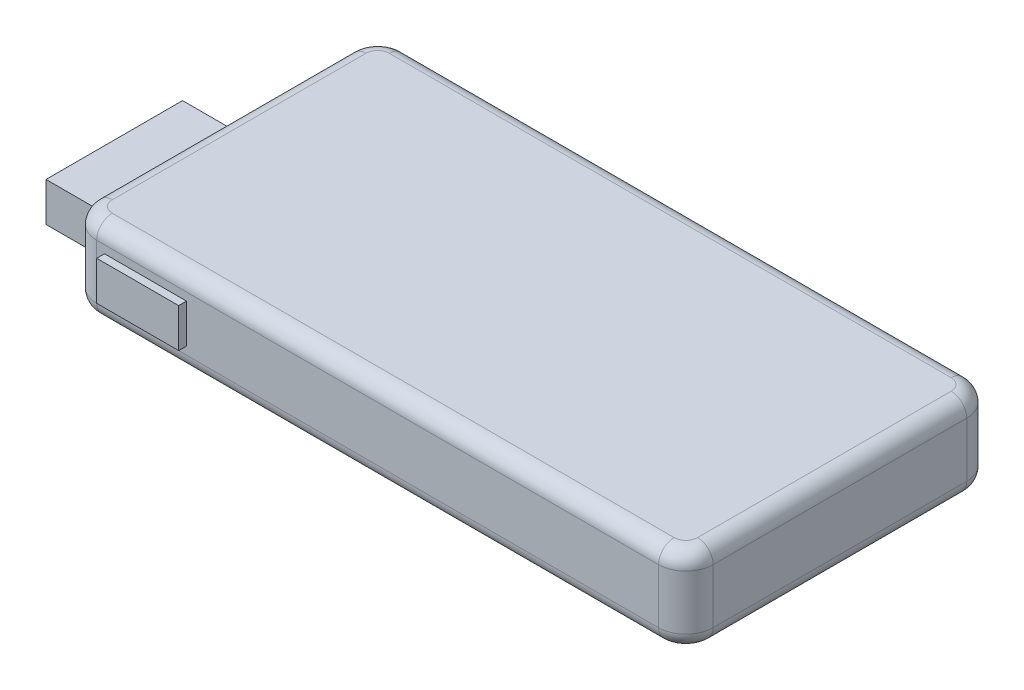
from build123d import *

# Parameters (mm, degrees)
BOSS_EXTRUDE1_DEPTH    = 22
FILLET1_R              = 4
FILLET2_R              = 4
SKETCH3_W              = 35
SKETCH3_H              = 10
BOSS_EXTRUDE3_DEPTH    = 15
BOSS_EXTRUDE4_DEPTH    = 1
BOSS_EXTRUDE4_2_DEPTH  = 1
BOSS_EXTRUDE4_3_DEPTH  = 1
BOSS_EXTRUDE4_4_DEPTH  = 1
BOSS_EXTRUDE4_5_DEPTH  = 1
BOSS_EXTRUDE4_6_DEPTH  = 1
BOSS_EXTRUDE4_7_DEPTH  = 1
BOSS_EXTRUDE4_8_DEPTH  = 1
BOSS_EXTRUDE4_9_DEPTH  = 1
BOSS_EXTRUDE4_10_DEPTH = 1
BOSS_EXTRUDE4_11_DEPTH = 1
BOSS_EXTRUDE4_12_DEPTH = 1
BOSS_EXTRUDE4_13_DEPTH = 1
BOSS_EXTRUDE4_14_DEPTH = 1
BOSS_EXTRUDE4_15_DEPTH = 1
BOSS_EXTRUDE4_16_DEPTH = 1
BOSS_EXTRUDE4_17_DEPTH = 1
BOSS_EXTRUDE4_18_DEPTH = 1
BOSS_EXTRUDE4_19_DEPTH = 1
BOSS_EXTRUDE4_20_DEPTH = 1
BOSS_EXTRUDE4_21_DEPTH = 1
BOSS_EXTRUDE4_22_DEPTH = 1
BOSS_EXTRUDE4_23_DEPTH = 1
BOSS_EXTRUDE4_24_DEPTH = 1
SKETCH5_W              = 21
SKETCH5_H              = 10
BOSS_EXTRUDE5_DEPTH    = 2


with BuildPart() as part:
    # Sketch1 → Boss-Extrude1 (new body)
    with BuildSketch(Plane(origin=(0, 0, 0), x_dir=(1, 0, 0), z_dir=(0, 1, 0))):
        with BuildLine():
            Line((-142.479581152, 4.653141361), (1.520418848, 4.653141361))
            ThreePointArc((1.520418848, 4.653141361), (6.470166316, 2.60288883), (8.520418848, -2.346858639))
            Line((8.520418848, -2.346858639), (8.520418848, -67.346858639))
            ThreePointArc((8.520418848, -67.346858639), (6.470166316, -72.296606107), (1.520418848, -74.346858639))
            Line((1.520418848, -74.346858639), (-142.479581152, -74.346858639))
            ThreePointArc((-142.479581152, -74.346858639), (-147.42932862, -72.296606107), (-149.479581152, -67.346858639))
            Line((-149.479581152, -67.346858639), (-149.479581152, -2.346858639))
            ThreePointArc((-149.479581152, -2.346858639), (-147.42932862, 2.60288883), (-142.479581152, 4.653141361))
        make_face()
    extrude(amount=BOSS_EXTRUDE1_DEPTH)

    # Fillet1
    fillet1_edges = [part.edges().sort_by_distance(p)[0] for p in [
        (6.470166316, 22, 72.296606107),
        (8.520418848, 22, 34.846858639),
        (6.470166316, 22, -2.60288883),
        (-70.479581152, 22, -4.653141361),
        (-147.42932862, 22, -2.60288883),
        (-149.479581152, 22, 34.846858639),
        (-147.42932862, 22, 72.296606107),
        (-70.479581152, 22, 74.346858639),
    ]]
    fillet(fillet1_edges, radius=FILLET1_R)

    # Fillet2
    fillet2_edges = [part.edges().sort_by_distance(p)[0] for p in [
        (8.520418848, 0, 34.846858639),
        (6.470166316, 0, 72.296606107),
        (-70.479581152, 0, 74.346858639),
        (-147.42932862, 0, 72.296606107),
        (-149.479581152, 0, 34.846858639),
        (-147.42932862, 0, -2.60288883),
        (-70.479581152, 0, -4.653141361),
        (6.470166316, 0, -2.60288883),
    ]]
    fillet(fillet2_edges, radius=FILLET2_R)

    # Sketch3 → Boss-Extrude3 (add)
    with BuildSketch(Plane.ZY.offset(149.479581152)):
        with Locations((47.846858639, 11)):
            Rectangle(SKETCH3_W, SKETCH3_H)
    extrude(amount=BOSS_EXTRUDE3_DEPTH)

    # Sketch5 → Boss-Extrude5 (add)
    with BuildSketch(Plane.XY.offset(74.346858639)):
        with Locations((-129.979581152, 11)):
            Rectangle(SKETCH5_W, SKETCH5_H)
    extrude(amount=BOSS_EXTRUDE5_DEPTH)


with BuildPart() as body_2:
    # Sketch4 → Boss-Extrude4 (new body)
    with BuildSketch(Plane.XY.offset(74.346858639)):
        Polygon((-114.223170895, 13), (-113.742401665, 13), (-112.075734998, 9.059695513), (-110.409068331, 13), (-109.928299101, 13), (-112.043683716, 8), (-112.10778628, 8), align=None)
    extrude(amount=-BOSS_EXTRUDE4_DEPTH)


with BuildPart() as body_3:
    # Sketch4 → Boss-Extrude4 2 (new body)
    with BuildSketch(Plane.XY.offset(74.346858639)):
        Polygon((-106.979581152, 13), (-104.671888844, 8), (-105.159669293, 8), (-105.898851985, 9.602564103), (-108.165478588, 9.602564103), (-108.925694934, 8), (-109.415478588, 8), (-107.043683716, 13), align=None)
        Polygon((-107.016640447, 12.025440705), (-107.922089165, 10.115384615), (-106.13523019, 10.115384615), align=None, mode=Mode.SUBTRACT)
    extrude(amount=-BOSS_EXTRUDE4_2_DEPTH)


with BuildPart() as body_4:
    # Sketch4 → Boss-Extrude4 3 (new body)
    with BuildSketch(Plane.XY.offset(74.346858639)):
        with BuildLine():
            Line((-103.774452947, 13), (-102.773851985, 13))
            add(Edge.make_bspline(
                [(-102.773851985, 13), (-102.707078944, 12.999777734), (-102.57886731, 12.99935096), (-102.395191209, 12.996971298), (-102.228295356, 12.99015079), (-102.078267014, 12.984281385), (-101.945108936, 12.973578612), (-101.828412806, 12.963349116), (-101.728716095, 12.949958172), (-101.668364879, 12.937521853), (-101.641039485, 12.931891026)],
                knots=[0, 0, 0, 0, 1.410062039, 2.707475311, 3.878576406, 4.937260626, 5.877586885, 6.699081471, 7.410979367, 8, 8, 8, 8], degree=3))
            add(Edge.make_bspline(
                [(-101.641039485, 12.931891026), (-101.604458594, 12.922852789), (-101.53207718, 12.904969127), (-101.4278628, 12.867169697), (-101.328556623, 12.823427376), (-101.23457116, 12.772050633), (-101.146377172, 12.712658091), (-101.0630653, 12.646275059), (-100.984257495, 12.573264765), (-100.91314088, 12.49178642), (-100.846085092, 12.406305692), (-100.789529911, 12.313871753), (-100.740777797, 12.217212428), (-100.701962773, 12.115344689), (-100.670708525, 12.009256443), (-100.648671041, 11.897986733), (-100.635455058, 11.782042483), (-100.63410955, 11.702959756), (-100.633427306, 11.662860577)],
                knots=[0, 0, 0, 0, 1.027469482, 2.033020251, 3.019912614, 3.986113645, 4.951240523, 5.91722682, 6.890402269, 7.87763091, 8.8651537, 9.85103654, 10.82876324, 11.815024772, 12.821070561, 13.842952187, 14.906261191, 16, 16, 16, 16], degree=3))
            add(Edge.make_bspline(
                [(-100.633427306, 11.662860577), (-100.635525874, 11.596238999), (-100.639620726, 11.466243045), (-100.677799445, 11.277584643), (-100.74033733, 11.101599908), (-100.826513458, 10.938510425), (-100.936255566, 10.791495217), (-101.068148124, 10.662365995), (-101.222264712, 10.554308977), (-101.365735164, 10.479376399), (-101.492469735, 10.43138653), (-101.596803039, 10.397620303), (-101.710613006, 10.371531781), (-101.832809199, 10.348160164), (-101.963900135, 10.330514886), (-102.10357162, 10.31759118), (-102.251923265, 10.309513968), (-102.353836221, 10.308311103), (-102.406263844, 10.307692308)],
                knots=[0, 0, 0, 0, 1.260483769, 2.459530307, 3.627416485, 4.787058657, 5.939039949, 7.08810263, 8.267026773, 9.491475466, 10.141966685, 10.831826277, 11.566392101, 12.351337768, 13.187381173, 14.07005841, 15.007169909, 16, 16, 16, 16], degree=3))
            Line((-102.406263844, 10.307692308), (-100.569324742, 8))
            Line((-100.569324742, 8), (-101.124212562, 8))
            Line((-101.124212562, 8), (-102.961151665, 10.307692308))
            Line((-102.961151665, 10.307692308), (-103.325734998, 10.307692308))
            Line((-103.325734998, 10.307692308), (-103.325734998, 8))
            Line((-103.325734998, 8), (-103.774452947, 8))
            Line((-103.774452947, 8), (-103.774452947, 13))
        make_face()
        with BuildLine():
            Line((-103.325734998, 12.487179487), (-103.325734998, 10.820512821))
            Line((-103.325734998, 10.820512821), (-102.410270254, 10.813501603))
            add(Edge.make_bspline(
                [(-102.410270254, 10.813501603), (-102.367527342, 10.813482693), (-102.284679403, 10.813446041), (-102.16482131, 10.819151436), (-102.053221151, 10.82564189), (-101.950305791, 10.835569527), (-101.856029254, 10.848363915), (-101.770438664, 10.864368178), (-101.693394304, 10.883013982), (-101.603539249, 10.911873447), (-101.503201347, 10.957596331), (-101.394156405, 11.024118472), (-101.301295922, 11.107788642), (-101.222841833, 11.203465008), (-101.159799788, 11.308659649), (-101.115353996, 11.422111605), (-101.087150507, 11.540956745), (-101.083824014, 11.622639756), (-101.082145254, 11.663862179)],
                knots=[0, 0, 0, 0, 1.146690395, 2.22261258, 3.21895312, 4.145990853, 4.996080663, 5.770904154, 6.481378293, 7.121626537, 8.300444488, 9.431385265, 10.535395872, 11.636531494, 12.74115979, 13.810798291, 14.895190096, 16, 16, 16, 16], degree=3))
            add(Edge.make_bspline(
                [(-101.082145254, 11.663862179), (-101.08386257, 11.704071571), (-101.087265664, 11.783751911), (-101.115049619, 11.900403212), (-101.162034449, 12.010498855), (-101.225351932, 12.113590976), (-101.302493582, 12.207170599), (-101.3929476, 12.287237961), (-101.494240736, 12.353308624), (-101.588913876, 12.395529168), (-101.67353418, 12.421414673), (-101.747005123, 12.439630621), (-101.83002152, 12.454265576), (-101.922986461, 12.465991378), (-102.025503076, 12.47606987), (-102.13808972, 12.482858125), (-102.259999406, 12.486877931), (-102.344495022, 12.487076629), (-102.388234998, 12.487179487)],
                knots=[0, 0, 0, 0, 1.101028733, 2.181837193, 3.264309656, 4.369019818, 5.486613113, 6.575447106, 7.666700264, 8.788928104, 9.402425223, 10.0903467, 10.862060571, 11.710948788, 12.657782767, 13.684531032, 14.801375019, 16, 16, 16, 16], degree=3))
            Line((-102.388234998, 12.487179487), (-103.325734998, 12.487179487))
        make_face(mode=Mode.SUBTRACT)
    extrude(amount=-BOSS_EXTRUDE4_3_DEPTH)


with BuildPart() as body_5:
    # Sketch4 → Boss-Extrude4 4 (new body)
    with BuildSketch(Plane.XY.offset(74.346858639)):
        Polygon((-100.120606793, 12.487179487), (-100.120606793, 13), (-97.492401665, 13), (-97.492401665, 12.487179487), (-98.582145254, 12.487179487), (-98.582145254, 8), (-99.030863203, 8), (-99.030863203, 12.487179487), align=None)
    extrude(amount=-BOSS_EXTRUDE4_4_DEPTH)


with BuildPart() as body_6:
    # Sketch4 → Boss-Extrude4 5 (new body)
    with BuildSketch(Plane.XY.offset(74.346858639)):
        Polygon((-94.671888844, 13), (-92.364196536, 8), (-92.851976985, 8), (-93.591159677, 9.602564103), (-95.85778628, 9.602564103), (-96.618002626, 8), (-97.10778628, 8), (-94.735991408, 13), align=None)
        Polygon((-94.708948139, 12.025440705), (-95.614396857, 10.115384615), (-93.827537883, 10.115384615), align=None, mode=Mode.SUBTRACT)
    extrude(amount=-BOSS_EXTRUDE4_5_DEPTH)


with BuildPart() as body_7:
    # Sketch4 → Boss-Extrude4 6 (new body)
    with BuildSketch(Plane.XY.offset(74.346858639)):
        with BuildLine():
            Line((-89.351376024, 11.461538462), (-89.800093972, 11.461538462))
            add(Edge.make_bspline(
                [(-89.800093972, 11.461538462), (-89.797169468, 11.521068301), (-89.791425819, 11.637983322), (-89.764528263, 11.808446045), (-89.726041296, 11.971381472), (-89.671624933, 12.125481349), (-89.604044536, 12.272108217), (-89.52300164, 12.410679668), (-89.427010425, 12.54066708), (-89.318143662, 12.660865428), (-89.199902749, 12.771133386), (-89.072322836, 12.866355162), (-88.938258511, 12.946808978), (-88.798116512, 13.014067895), (-88.650315707, 13.064553389), (-88.496197339, 13.102012874), (-88.335084287, 13.124550511), (-88.225312827, 13.126973062), (-88.169484998, 13.128205128)],
                knots=[0, 0, 0, 0, 1.10065271, 2.161652631, 3.183658789, 4.190468796, 5.17591951, 6.163126047, 7.15150782, 8.156236427, 9.156009102, 10.134482811, 11.092018607, 12.041330605, 13.001268258, 13.972401359, 14.968799086, 16, 16, 16, 16], degree=3))
            add(Edge.make_bspline(
                [(-88.169484998, 13.128205128), (-88.114659178, 13.126921619), (-88.0069284, 13.124399569), (-87.849696951, 13.102740956), (-87.700015101, 13.068818682), (-87.558175435, 13.02122523), (-87.425309628, 12.957247477), (-87.300419565, 12.88039385), (-87.182018406, 12.791508377), (-87.075437287, 12.686860072), (-86.977568602, 12.57514238), (-86.893136809, 12.455873946), (-86.82083229, 12.332689252), (-86.760564176, 12.204648964), (-86.716198263, 12.070547495), (-86.682515109, 11.932337205), (-86.663475946, 11.788587475), (-86.660553913, 11.691292396), (-86.659068331, 11.641826923)],
                knots=[0, 0, 0, 0, 1.111607364, 2.184268762, 3.212621178, 4.221274766, 5.211760367, 6.196651075, 7.1921475, 8.207485113, 9.220403448, 10.201281604, 11.166441695, 12.114753415, 13.065576456, 14.026450734, 14.996634279, 16, 16, 16, 16], degree=3))
            add(Edge.make_bspline(
                [(-86.659068331, 11.641826923), (-86.661487278, 11.572187159), (-86.666282723, 11.434129711), (-86.707303261, 11.231251336), (-86.771369705, 11.034689309), (-86.848508787, 10.876493163), (-86.926326564, 10.749016743), (-86.996451575, 10.64406145), (-87.078544162, 10.531053638), (-87.173799159, 10.410371728), (-87.280246119, 10.281070435), (-87.39884921, 10.14322787), (-87.530454184, 9.998268199), (-87.622823471, 9.899260197), (-87.670686921, 9.847956731)],
                knots=[0, 0, 0, 0, 1.184426356, 2.348067706, 3.509069118, 4.696110526, 5.333549288, 6.050745305, 6.844228056, 7.710549037, 8.667450064, 9.695053472, 10.805634456, 12, 12, 12, 12], degree=3))
            Line((-87.670686921, 9.847956731), (-88.921688524, 8.512820513))
            Line((-88.921688524, 8.512820513), (-86.594965767, 8.512820513))
            Line((-86.594965767, 8.512820513), (-86.594965767, 8))
            Line((-86.594965767, 8), (-89.992401665, 8))
            Line((-89.992401665, 8), (-88.053299101, 10.069310897))
            add(Edge.make_bspline(
                [(-88.053299101, 10.069310897), (-88.006087834, 10.118594193), (-87.915404652, 10.213257316), (-87.787143828, 10.351461545), (-87.671945273, 10.479675175), (-87.569063284, 10.597655958), (-87.480729705, 10.707129626), (-87.402340802, 10.804550632), (-87.339532815, 10.894199846), (-87.271367964, 10.998115009), (-87.20534799, 11.124989748), (-87.148616053, 11.280037875), (-87.114023412, 11.439648236), (-87.109873647, 11.547508289), (-87.10778628, 11.601762821)],
                knots=[0, 0, 0, 0, 1.329631726, 2.553950428, 3.673215718, 4.687767853, 5.603093632, 6.413772471, 7.123043292, 7.734684054, 8.834405432, 9.900288307, 10.943827018, 12, 12, 12, 12], degree=3))
            add(Edge.make_bspline(
                [(-87.10778628, 11.601762821), (-87.108694483, 11.635879104), (-87.110484378, 11.703115747), (-87.126281088, 11.801695403), (-87.15015324, 11.896787994), (-87.184360751, 11.988686022), (-87.229513237, 12.076465524), (-87.284475209, 12.160233353), (-87.347889585, 12.241217589), (-87.421248541, 12.317150872), (-87.501836426, 12.386695452), (-87.586971069, 12.448301288), (-87.677042646, 12.499785732), (-87.771671392, 12.541990728), (-87.870593491, 12.575098415), (-87.97400027, 12.598039243), (-88.081606008, 12.612442792), (-88.15508243, 12.614391609), (-88.192521857, 12.615384615)],
                knots=[0, 0, 0, 0, 0.991446411, 1.95395049, 2.89581595, 3.838931463, 4.798493298, 5.75982156, 6.748411868, 7.785213223, 8.824556874, 9.840280684, 10.836137867, 11.835679398, 12.848801643, 13.863922112, 14.911575587, 16, 16, 16, 16], degree=3))
            add(Edge.make_bspline(
                [(-88.192521857, 12.615384615), (-88.231623047, 12.614363141), (-88.308411327, 12.612357133), (-88.421152803, 12.598324756), (-88.528703913, 12.574116413), (-88.631335203, 12.541006878), (-88.729220326, 12.498923237), (-88.821883246, 12.446506458), (-88.909115945, 12.383958611), (-88.991082407, 12.313043531), (-89.066602377, 12.234089815), (-89.132955057, 12.146075582), (-89.19093222, 12.050607845), (-89.241516839, 11.947944202), (-89.282596396, 11.837153087), (-89.313986611, 11.718627795), (-89.338824964, 11.592882964), (-89.34712285, 11.506047129), (-89.351376024, 11.461538462)],
                knots=[0, 0, 0, 0, 1.031018746, 2.02475058, 2.990194455, 3.934040569, 4.864654155, 5.795059489, 6.735614925, 7.690564532, 8.649604399, 9.611025574, 10.590972636, 11.591080095, 12.624614302, 13.701020113, 14.821632451, 16, 16, 16, 16], degree=3))
        make_face()
    extrude(amount=-BOSS_EXTRUDE4_6_DEPTH)


with BuildPart() as body_8:
    # Sketch4 → Boss-Extrude4 7 (new body)
    with BuildSketch(Plane.XY.offset(74.346858639)):
        with BuildLine():
            add(Edge.make_bspline(
                [(-86.146247818, 10.497996795), (-86.145779221, 10.57813592), (-86.144868964, 10.733807326), (-86.134742648, 10.960642529), (-86.117920731, 11.173442942), (-86.094867341, 11.372218751), (-86.066813084, 11.557021271), (-86.029362388, 11.727356639), (-85.98677267, 11.88401322), (-85.937412033, 12.02750186), (-85.881715192, 12.159755722), (-85.82109482, 12.283220295), (-85.753145113, 12.39770877), (-85.681749523, 12.50504847), (-85.604017992, 12.60348232), (-85.522162578, 12.694400409), (-85.432988469, 12.775701482), (-85.339527028, 12.849767628), (-85.240932079, 12.914695444), (-85.140013985, 12.971885071), (-85.036078119, 13.020742024), (-84.928840715, 13.059156933), (-84.819265632, 13.090886714), (-84.706969823, 13.11258521), (-84.591767874, 13.126237937), (-84.514008682, 13.127543176), (-84.474573139, 13.128205128)],
                knots=[0, 0, 0, 0, 1.646270934, 3.197905019, 4.663502075, 6.030701355, 7.308322542, 8.50163776, 9.611534131, 10.641858119, 11.616356847, 12.558055219, 13.465016945, 14.349605745, 15.204443733, 16.039544428, 16.859896111, 17.680448484, 18.487036065, 19.28249412, 20.06191084, 20.843045899, 21.620316918, 22.403196591, 23.190181807, 24, 24, 24, 24], degree=3))
            add(Edge.make_bspline(
                [(-84.474573139, 13.128205128), (-84.43480817, 13.127508249), (-84.355728157, 13.126122377), (-84.238813335, 13.112802459), (-84.124599504, 13.090700854), (-84.013573592, 13.059385176), (-83.904823611, 13.02053421), (-83.799200172, 12.971838328), (-83.696047198, 12.915154232), (-83.59700393, 12.848548693), (-83.500983051, 12.774288298), (-83.410343104, 12.690341629), (-83.325075838, 12.597556315), (-83.244111116, 12.496925081), (-83.169745977, 12.386517817), (-83.098926789, 12.268254803), (-83.035538166, 12.140067853), (-82.97448863, 12.004095757), (-82.921792934, 11.856576244), (-82.874269727, 11.698340872), (-82.8358712, 11.527520605), (-82.803886526, 11.345011683), (-82.779108103, 11.15014385), (-82.761061471, 10.943334828), (-82.751528493, 10.724448555), (-82.749733205, 10.574794485), (-82.748811921, 10.497996795)],
                knots=[0, 0, 0, 0, 0.810914788, 1.612654377, 2.396697861, 3.181598691, 3.963628158, 4.749916497, 5.551656086, 6.361998678, 7.18212741, 8.025565596, 8.878627764, 9.750805457, 10.657531673, 11.591944965, 12.560506719, 13.57287815, 14.630710178, 15.753379473, 16.941251878, 18.199788006, 19.531962791, 20.947069417, 22.433333509, 24, 24, 24, 24], degree=3))
            add(Edge.make_bspline(
                [(-82.748811921, 10.497996795), (-82.749742756, 10.421534069), (-82.75155645, 10.272549567), (-82.760954603, 10.054648173), (-82.779466933, 9.848936683), (-82.802624059, 9.654921736), (-82.834696863, 9.473410852), (-82.874132815, 9.303775926), (-82.917918991, 9.145284395), (-82.971968697, 8.999234664), (-83.031126854, 8.863589346), (-83.09549142, 8.736921991), (-83.164448315, 8.618113002), (-83.239575093, 8.508113363), (-83.319651398, 8.406143853), (-83.406391096, 8.314004392), (-83.497349075, 8.229474861), (-83.593652526, 8.15425825), (-83.694240456, 8.088422815), (-83.797039138, 8.029545886), (-83.903872542, 7.982070607), (-84.012319618, 7.941306263), (-84.123931569, 7.91016276), (-84.23856927, 7.888628681), (-84.355649607, 7.87352604), (-84.4347947, 7.872373926), (-84.474573139, 7.871794872)],
                knots=[0, 0, 0, 0, 1.561518951, 3.042555995, 4.452378317, 5.7783523, 7.031515105, 8.214008947, 9.334062868, 10.386615937, 11.391082383, 12.354592575, 13.286541444, 14.194233754, 15.072674879, 15.931287219, 16.775624067, 17.606195743, 18.42308326, 19.229000347, 20.022332153, 20.807536673, 21.593273796, 22.3848459, 23.188221202, 24, 24, 24, 24], degree=3))
            add(Edge.make_bspline(
                [(-84.474573139, 7.871794872), (-84.514007588, 7.872461094), (-84.591764623, 7.873774754), (-84.706982374, 7.887365799), (-84.818814436, 7.909216518), (-84.927812656, 7.939811666), (-85.034536249, 7.977261433), (-85.137530944, 8.026052409), (-85.237941921, 8.082243936), (-85.335501286, 8.146237395), (-85.428375802, 8.219554086), (-85.517088095, 8.300645927), (-85.599409551, 8.391536514), (-85.676029688, 8.49079069), (-85.748849814, 8.597495322), (-85.815834633, 8.713107283), (-85.877792996, 8.837168155), (-85.934426554, 8.970479456), (-85.98463893, 9.114986496), (-86.028992799, 9.272342466), (-86.064013024, 9.443936231), (-86.093988675, 9.628389613), (-86.118166365, 9.826495228), (-86.134672544, 10.038360625), (-86.144874422, 10.263853781), (-86.145781666, 10.418524887), (-86.146247818, 10.497996795)],
                knots=[0, 0, 0, 0, 0.810891512, 1.598919785, 2.382837074, 3.152667961, 3.926044502, 4.706494248, 5.493654104, 6.291793342, 7.103789334, 7.925228297, 8.761435821, 9.622817696, 10.50288917, 11.416980706, 12.369136599, 13.353924996, 14.394355917, 15.514179734, 16.714354668, 17.994756427, 19.357759367, 20.818452758, 22.365282078, 24, 24, 24, 24], degree=3))
        make_face()
        with BuildLine():
            add(Edge.make_bspline(
                [(-85.69752987, 10.5), (-85.697359231, 10.433216145), (-85.697028055, 10.303601795), (-85.68837634, 10.115254279), (-85.676590294, 9.939582381), (-85.661388441, 9.776363043), (-85.6388128, 9.626148739), (-85.613517389, 9.487906335), (-85.582734404, 9.362367425), (-85.54631295, 9.248670552), (-85.504828526, 9.144886169), (-85.459534435, 9.048313004), (-85.410876259, 8.957810238), (-85.35642033, 8.874190798), (-85.297113097, 8.797181992), (-85.234294155, 8.725420803), (-85.165619035, 8.661425115), (-85.070613688, 8.584672465), (-84.945190153, 8.505359417), (-84.787160932, 8.436293574), (-84.62477743, 8.392890065), (-84.514561359, 8.387370414), (-84.459549101, 8.384615385)],
                knots=[0, 0, 0, 0, 1.459021318, 2.831673884, 4.118529203, 5.306027144, 6.411944654, 7.436330062, 8.375795394, 9.233974572, 10.042671642, 10.816086306, 11.563610507, 12.285937304, 12.993564865, 13.685989202, 14.367179055, 15.041617293, 16.353048772, 17.594441528, 18.799311195, 20, 20, 20, 20], degree=3))
            add(Edge.make_bspline(
                [(-84.459549101, 8.384615385), (-84.404180998, 8.386897929), (-84.293559108, 8.391458304), (-84.131939401, 8.4354565), (-83.975039015, 8.501841557), (-83.8520791, 8.580337993), (-83.758532609, 8.655092749), (-83.691508338, 8.718827961), (-83.629991126, 8.790193486), (-83.571645304, 8.86719248), (-83.518132339, 8.951296029), (-83.469470714, 9.042099708), (-83.425065932, 9.139855676), (-83.399767295, 9.208098161), (-83.386832754, 9.242988782)],
                knots=[0, 0, 0, 0, 1.353760809, 2.704726607, 4.075137775, 5.516104923, 6.260822281, 7.007110065, 7.778089737, 8.566572457, 9.372053459, 10.217411131, 11.088608312, 12, 12, 12, 12], degree=3))
            add(Edge.make_bspline(
                [(-83.386832754, 9.242988782), (-83.3717588, 9.287602696), (-83.341152209, 9.378188073), (-83.301706817, 9.518707576), (-83.270641961, 9.666140096), (-83.242694296, 9.819604548), (-83.223618502, 9.980232693), (-83.208264483, 10.147527527), (-83.199220644, 10.321615187), (-83.198099571, 10.439893746), (-83.19752987, 10.5)],
                knots=[0, 0, 0, 0, 0.884706709, 1.796334032, 2.740027952, 3.714592787, 4.726048262, 5.777819803, 6.87074269, 8, 8, 8, 8], degree=3))
            add(Edge.make_bspline(
                [(-83.19752987, 10.5), (-83.198315854, 10.560096532), (-83.199853408, 10.677658196), (-83.205730534, 10.849827026), (-83.220907069, 11.013352398), (-83.237762953, 11.168938788), (-83.262616126, 11.315724935), (-83.289412993, 11.454939656), (-83.325414725, 11.584858263), (-83.363871546, 11.707514809), (-83.407886397, 11.821515744), (-83.456337446, 11.927392581), (-83.508082815, 12.025656474), (-83.564286016, 12.116037819), (-83.624279849, 12.198941452), (-83.689647776, 12.272705158), (-83.75779688, 12.339615113), (-83.853250003, 12.415990211), (-83.978213274, 12.493864062), (-84.133707056, 12.565529433), (-84.295522262, 12.606684137), (-84.404912911, 12.612486547), (-84.459549101, 12.615384615)],
                knots=[0, 0, 0, 0, 1.31362396, 2.569729283, 3.763502607, 4.902122613, 5.988968491, 7.01645872, 7.998833611, 8.933434873, 9.825090667, 10.667526885, 11.477055099, 12.250526234, 12.991942729, 13.710640831, 14.402115721, 15.076753259, 16.378508321, 17.609869233, 18.806226677, 20, 20, 20, 20], degree=3))
            add(Edge.make_bspline(
                [(-84.459549101, 12.615384615), (-84.514849946, 12.612482549), (-84.625552383, 12.606673129), (-84.789049461, 12.565682766), (-84.945769963, 12.494235672), (-85.070402784, 12.415732283), (-85.165922479, 12.340963267), (-85.23318347, 12.276125475), (-85.29624943, 12.205202255), (-85.354346145, 12.127485233), (-85.408759407, 12.04396328), (-85.458732282, 11.95397933), (-85.503757038, 11.857077381), (-85.545306376, 11.753339617), (-85.58183893, 11.639652553), (-85.611973163, 11.514268277), (-85.639811811, 11.376465574), (-85.659519338, 11.225437706), (-85.677038989, 11.062177486), (-85.688298057, 10.886067032), (-85.697056996, 10.697403631), (-85.697369088, 10.567119119), (-85.69752987, 10.5)],
                knots=[0, 0, 0, 0, 1.207732386, 2.417664972, 3.655092373, 4.956220595, 5.625982001, 6.301752483, 6.994047911, 7.697131622, 8.419323945, 9.170223765, 9.943494443, 10.752040957, 11.610060368, 12.549350801, 13.567764191, 14.679664412, 15.874934091, 17.154273443, 18.533957287, 20, 20, 20, 20], degree=3))
        make_face(mode=Mode.SUBTRACT)
    extrude(amount=-BOSS_EXTRUDE4_7_DEPTH)


with BuildPart() as body_9:
    # Sketch4 → Boss-Extrude4 8 (new body)
    with BuildSketch(Plane.XY.offset(74.346858639)):
        with BuildLine():
            add(Edge.make_bspline(
                [(-82.300093972, 10.497996795), (-82.299625375, 10.57813592), (-82.298715118, 10.733807326), (-82.288588802, 10.960642529), (-82.271766885, 11.173442942), (-82.248713495, 11.372218751), (-82.220659237, 11.557021271), (-82.183208542, 11.727356639), (-82.140618824, 11.88401322), (-82.091258187, 12.02750186), (-82.035561346, 12.159755722), (-81.974940973, 12.283220295), (-81.906991267, 12.39770877), (-81.835595677, 12.50504847), (-81.757864146, 12.60348232), (-81.676008731, 12.694400409), (-81.586834622, 12.775701482), (-81.493373182, 12.849767628), (-81.394778233, 12.914695444), (-81.293860138, 12.971885071), (-81.189924273, 13.020742024), (-81.082686869, 13.059156933), (-80.973111786, 13.090886714), (-80.860815976, 13.11258521), (-80.745614028, 13.126237937), (-80.667854835, 13.127543176), (-80.628419293, 13.128205128)],
                knots=[0, 0, 0, 0, 1.646270934, 3.197905019, 4.663502075, 6.030701355, 7.308322542, 8.50163776, 9.611534131, 10.641858119, 11.616356847, 12.558055219, 13.465016945, 14.349605745, 15.204443733, 16.039544428, 16.859896111, 17.680448484, 18.487036065, 19.28249412, 20.06191084, 20.843045899, 21.620316918, 22.403196591, 23.190181807, 24, 24, 24, 24], degree=3))
            add(Edge.make_bspline(
                [(-80.628419293, 13.128205128), (-80.588654324, 13.127508249), (-80.509574311, 13.126122377), (-80.392659489, 13.112802459), (-80.278445658, 13.090700854), (-80.167419746, 13.059385176), (-80.058669765, 13.02053421), (-79.953046325, 12.971838328), (-79.849893352, 12.915154232), (-79.750850084, 12.848548693), (-79.654829205, 12.774288298), (-79.564189258, 12.690341629), (-79.478921992, 12.597556315), (-79.39795727, 12.496925081), (-79.323592131, 12.386517817), (-79.252772942, 12.268254803), (-79.18938432, 12.140067853), (-79.128334784, 12.004095757), (-79.075639088, 11.856576244), (-79.028115881, 11.698340872), (-78.989717354, 11.527520605), (-78.957732679, 11.345011683), (-78.932954257, 11.15014385), (-78.914907625, 10.943334828), (-78.905374647, 10.724448555), (-78.903579359, 10.574794485), (-78.902658075, 10.497996795)],
                knots=[0, 0, 0, 0, 0.810914788, 1.612654377, 2.396697861, 3.181598691, 3.963628158, 4.749916497, 5.551656086, 6.361998678, 7.18212741, 8.025565596, 8.878627764, 9.750805457, 10.657531673, 11.591944965, 12.560506719, 13.57287815, 14.630710178, 15.753379473, 16.941251878, 18.199788006, 19.531962791, 20.947069417, 22.433333509, 24, 24, 24, 24], degree=3))
            add(Edge.make_bspline(
                [(-78.902658075, 10.497996795), (-78.90358891, 10.421534069), (-78.905402604, 10.272549567), (-78.914800757, 10.054648173), (-78.933313087, 9.848936683), (-78.956470213, 9.654921736), (-78.988543017, 9.473410852), (-79.027978969, 9.303775926), (-79.071765145, 9.145284395), (-79.12581485, 8.999234664), (-79.184973008, 8.863589346), (-79.249337574, 8.736921991), (-79.318294468, 8.618113002), (-79.393421247, 8.508113363), (-79.473497552, 8.406143853), (-79.56023725, 8.314004392), (-79.651195229, 8.229474861), (-79.74749868, 8.15425825), (-79.84808661, 8.088422815), (-79.950885291, 8.029545886), (-80.057718696, 7.982070607), (-80.166165772, 7.941306263), (-80.277777723, 7.91016276), (-80.392415424, 7.888628681), (-80.509495761, 7.87352604), (-80.588640854, 7.872373926), (-80.628419293, 7.871794872)],
                knots=[0, 0, 0, 0, 1.561518951, 3.042555995, 4.452378317, 5.7783523, 7.031515105, 8.214008947, 9.334062868, 10.386615937, 11.391082383, 12.354592575, 13.286541444, 14.194233754, 15.072674879, 15.931287219, 16.775624067, 17.606195743, 18.42308326, 19.229000347, 20.022332153, 20.807536673, 21.593273796, 22.3848459, 23.188221202, 24, 24, 24, 24], degree=3))
            add(Edge.make_bspline(
                [(-80.628419293, 7.871794872), (-80.667853741, 7.872461094), (-80.745610777, 7.873774754), (-80.860828527, 7.887365799), (-80.972660589, 7.909216518), (-81.08165881, 7.939811666), (-81.188382403, 7.977261433), (-81.291377098, 8.026052409), (-81.391788074, 8.082243936), (-81.48934744, 8.146237395), (-81.582221956, 8.219554086), (-81.670934249, 8.300645927), (-81.753255705, 8.391536514), (-81.829875842, 8.49079069), (-81.902695968, 8.597495322), (-81.969680787, 8.713107283), (-82.03163915, 8.837168155), (-82.088272708, 8.970479456), (-82.138485084, 9.114986496), (-82.182838953, 9.272342466), (-82.217859178, 9.443936231), (-82.247834828, 9.628389613), (-82.272012518, 9.826495228), (-82.288518697, 10.038360625), (-82.298720576, 10.263853781), (-82.29962782, 10.418524887), (-82.300093972, 10.497996795)],
                knots=[0, 0, 0, 0, 0.810891512, 1.598919785, 2.382837074, 3.152667961, 3.926044502, 4.706494248, 5.493654104, 6.291793342, 7.103789334, 7.925228297, 8.761435821, 9.622817696, 10.50288917, 11.416980706, 12.369136599, 13.353924996, 14.394355917, 15.514179734, 16.714354668, 17.994756427, 19.357759367, 20.818452758, 22.365282078, 24, 24, 24, 24], degree=3))
        make_face()
        with BuildLine():
            add(Edge.make_bspline(
                [(-81.851376024, 10.5), (-81.851205385, 10.433216145), (-81.850874209, 10.303601795), (-81.842222494, 10.115254279), (-81.830436448, 9.939582381), (-81.815234595, 9.776363043), (-81.792658954, 9.626148739), (-81.767363543, 9.487906335), (-81.736580558, 9.362367425), (-81.700159104, 9.248670552), (-81.65867468, 9.144886169), (-81.613380589, 9.048313004), (-81.564722413, 8.957810238), (-81.510266484, 8.874190798), (-81.45095925, 8.797181992), (-81.388140309, 8.725420803), (-81.319465188, 8.661425115), (-81.224459842, 8.584672465), (-81.099036307, 8.505359417), (-80.941007085, 8.436293574), (-80.778623584, 8.392890065), (-80.668407512, 8.387370414), (-80.613395254, 8.384615385)],
                knots=[0, 0, 0, 0, 1.459021318, 2.831673884, 4.118529203, 5.306027144, 6.411944654, 7.436330062, 8.375795394, 9.233974572, 10.042671642, 10.816086306, 11.563610507, 12.285937304, 12.993564865, 13.685989202, 14.367179055, 15.041617293, 16.353048772, 17.594441528, 18.799311195, 20, 20, 20, 20], degree=3))
            add(Edge.make_bspline(
                [(-80.613395254, 8.384615385), (-80.558027152, 8.386897929), (-80.447405262, 8.391458304), (-80.285785554, 8.4354565), (-80.128885169, 8.501841557), (-80.005925254, 8.580337993), (-79.912378763, 8.655092749), (-79.845354492, 8.718827961), (-79.78383728, 8.790193486), (-79.725491458, 8.86719248), (-79.671978493, 8.951296029), (-79.623316868, 9.042099708), (-79.578912086, 9.139855676), (-79.553613449, 9.208098161), (-79.540678908, 9.242988782)],
                knots=[0, 0, 0, 0, 1.353760809, 2.704726607, 4.075137775, 5.516104923, 6.260822281, 7.007110065, 7.778089737, 8.566572457, 9.372053459, 10.217411131, 11.088608312, 12, 12, 12, 12], degree=3))
            add(Edge.make_bspline(
                [(-79.540678908, 9.242988782), (-79.525604954, 9.287602696), (-79.494998363, 9.378188073), (-79.455552971, 9.518707576), (-79.424488115, 9.666140096), (-79.39654045, 9.819604548), (-79.377464656, 9.980232693), (-79.362110637, 10.147527527), (-79.353066798, 10.321615187), (-79.351945725, 10.439893746), (-79.351376024, 10.5)],
                knots=[0, 0, 0, 0, 0.884706709, 1.796334032, 2.740027952, 3.714592787, 4.726048262, 5.777819803, 6.87074269, 8, 8, 8, 8], degree=3))
            add(Edge.make_bspline(
                [(-79.351376024, 10.5), (-79.352162008, 10.560096532), (-79.353699562, 10.677658196), (-79.359576687, 10.849827026), (-79.374753222, 11.013352398), (-79.391609107, 11.168938788), (-79.41646228, 11.315724935), (-79.443259147, 11.454939656), (-79.479260878, 11.584858263), (-79.5177177, 11.707514809), (-79.561732551, 11.821515744), (-79.610183599, 11.927392581), (-79.661928969, 12.025656474), (-79.71813217, 12.116037819), (-79.778126003, 12.198941452), (-79.84349393, 12.272705158), (-79.911643034, 12.339615113), (-80.007096157, 12.415990211), (-80.132059428, 12.493864062), (-80.28755321, 12.565529433), (-80.449368416, 12.606684137), (-80.558759065, 12.612486547), (-80.613395254, 12.615384615)],
                knots=[0, 0, 0, 0, 1.31362396, 2.569729283, 3.763502607, 4.902122613, 5.988968491, 7.01645872, 7.998833611, 8.933434873, 9.825090667, 10.667526885, 11.477055099, 12.250526234, 12.991942729, 13.710640831, 14.402115721, 15.076753259, 16.378508321, 17.609869233, 18.806226677, 20, 20, 20, 20], degree=3))
            add(Edge.make_bspline(
                [(-80.613395254, 12.615384615), (-80.6686961, 12.612482549), (-80.779398537, 12.606673129), (-80.942895615, 12.565682766), (-81.099616117, 12.494235672), (-81.224248938, 12.415732283), (-81.319768633, 12.340963267), (-81.387029624, 12.276125475), (-81.450095584, 12.205202255), (-81.508192299, 12.127485233), (-81.56260556, 12.04396328), (-81.612578435, 11.95397933), (-81.657603192, 11.857077381), (-81.69915253, 11.753339617), (-81.735685084, 11.639652553), (-81.765819317, 11.514268277), (-81.793657964, 11.376465574), (-81.813365491, 11.225437706), (-81.830885142, 11.062177486), (-81.842144211, 10.886067032), (-81.85090315, 10.697403631), (-81.851215242, 10.567119119), (-81.851376024, 10.5)],
                knots=[0, 0, 0, 0, 1.207732386, 2.417664972, 3.655092373, 4.956220595, 5.625982001, 6.301752483, 6.994047911, 7.697131622, 8.419323945, 9.170223765, 9.943494443, 10.752040957, 11.610060368, 12.549350801, 13.567764191, 14.679664412, 15.874934091, 17.154273443, 18.533957287, 20, 20, 20, 20], degree=3))
        make_face(mode=Mode.SUBTRACT)
    extrude(amount=-BOSS_EXTRUDE4_8_DEPTH)


with BuildPart() as body_10:
    # Sketch4 → Boss-Extrude4 9 (new body)
    with BuildSketch(Plane.XY.offset(74.346858639)):
        with BuildLine():
            add(Edge.make_bspline(
                [(-78.453940126, 10.497996795), (-78.453471529, 10.57813592), (-78.452561272, 10.733807326), (-78.442434956, 10.960642529), (-78.425613038, 11.173442942), (-78.402559649, 11.372218751), (-78.374505391, 11.557021271), (-78.337054696, 11.727356639), (-78.294464978, 11.88401322), (-78.245104341, 12.02750186), (-78.1894075, 12.159755722), (-78.128787127, 12.283220295), (-78.060837421, 12.39770877), (-77.989441831, 12.50504847), (-77.9117103, 12.60348232), (-77.829854885, 12.694400409), (-77.740680776, 12.775701482), (-77.647219336, 12.849767628), (-77.548624387, 12.914695444), (-77.447706292, 12.971885071), (-77.343770427, 13.020742024), (-77.236533023, 13.059156933), (-77.12695794, 13.090886714), (-77.01466213, 13.11258521), (-76.899460182, 13.126237937), (-76.821700989, 13.127543176), (-76.782265447, 13.128205128)],
                knots=[0, 0, 0, 0, 1.646270934, 3.197905019, 4.663502075, 6.030701355, 7.308322542, 8.50163776, 9.611534131, 10.641858119, 11.616356847, 12.558055219, 13.465016945, 14.349605745, 15.204443733, 16.039544428, 16.859896111, 17.680448484, 18.487036065, 19.28249412, 20.06191084, 20.843045899, 21.620316918, 22.403196591, 23.190181807, 24, 24, 24, 24], degree=3))
            add(Edge.make_bspline(
                [(-76.782265447, 13.128205128), (-76.742500477, 13.127508249), (-76.663420465, 13.126122377), (-76.546505643, 13.112802459), (-76.432291812, 13.090700854), (-76.321265899, 13.059385176), (-76.212515919, 13.02053421), (-76.106892479, 12.971838328), (-76.003739506, 12.915154232), (-75.904696238, 12.848548693), (-75.808675359, 12.774288298), (-75.718035412, 12.690341629), (-75.632768146, 12.597556315), (-75.551803424, 12.496925081), (-75.477438285, 12.386517817), (-75.406619096, 12.268254803), (-75.343230473, 12.140067853), (-75.282180938, 12.004095757), (-75.229485242, 11.856576244), (-75.181962035, 11.698340872), (-75.143563508, 11.527520605), (-75.111578833, 11.345011683), (-75.086800411, 11.15014385), (-75.068753779, 10.943334828), (-75.0592208, 10.724448555), (-75.057425513, 10.574794485), (-75.056504229, 10.497996795)],
                knots=[0, 0, 0, 0, 0.810914788, 1.612654377, 2.396697861, 3.181598691, 3.963628158, 4.749916497, 5.551656086, 6.361998678, 7.18212741, 8.025565596, 8.878627764, 9.750805457, 10.657531673, 11.591944965, 12.560506719, 13.57287815, 14.630710178, 15.753379473, 16.941251878, 18.199788006, 19.531962791, 20.947069417, 22.433333509, 24, 24, 24, 24], degree=3))
            add(Edge.make_bspline(
                [(-75.056504229, 10.497996795), (-75.057435064, 10.421534069), (-75.059248758, 10.272549567), (-75.068646911, 10.054648173), (-75.087159241, 9.848936683), (-75.110316367, 9.654921736), (-75.142389171, 9.473410852), (-75.181825123, 9.303775926), (-75.225611298, 9.145284395), (-75.279661004, 8.999234664), (-75.338819162, 8.863589346), (-75.403183728, 8.736921991), (-75.472140622, 8.618113002), (-75.547267401, 8.508113363), (-75.627343705, 8.406143853), (-75.714083404, 8.314004392), (-75.805041382, 8.229474861), (-75.901344834, 8.15425825), (-76.001932764, 8.088422815), (-76.104731445, 8.029545886), (-76.21156485, 7.982070607), (-76.320011925, 7.941306263), (-76.431623877, 7.91016276), (-76.546261578, 7.888628681), (-76.663341915, 7.87352604), (-76.742487008, 7.872373926), (-76.782265447, 7.871794872)],
                knots=[0, 0, 0, 0, 1.561518951, 3.042555995, 4.452378317, 5.7783523, 7.031515105, 8.214008947, 9.334062868, 10.386615937, 11.391082383, 12.354592575, 13.286541444, 14.194233754, 15.072674879, 15.931287219, 16.775624067, 17.606195743, 18.42308326, 19.229000347, 20.022332153, 20.807536673, 21.593273796, 22.3848459, 23.188221202, 24, 24, 24, 24], degree=3))
            add(Edge.make_bspline(
                [(-76.782265447, 7.871794872), (-76.821699895, 7.872461094), (-76.899456931, 7.873774754), (-77.014674681, 7.887365799), (-77.126506743, 7.909216518), (-77.235504963, 7.939811666), (-77.342228556, 7.977261433), (-77.445223252, 8.026052409), (-77.545634228, 8.082243936), (-77.643193594, 8.146237395), (-77.73606811, 8.219554086), (-77.824780403, 8.300645927), (-77.907101859, 8.391536514), (-77.983721996, 8.49079069), (-78.056542122, 8.597495322), (-78.123526941, 8.713107283), (-78.185485304, 8.837168155), (-78.242118862, 8.970479456), (-78.292331238, 9.114986496), (-78.336685107, 9.272342466), (-78.371705332, 9.443936231), (-78.401680982, 9.628389613), (-78.425858672, 9.826495228), (-78.442364851, 10.038360625), (-78.45256673, 10.263853781), (-78.453473973, 10.418524887), (-78.453940126, 10.497996795)],
                knots=[0, 0, 0, 0, 0.810891512, 1.598919785, 2.382837074, 3.152667961, 3.926044502, 4.706494248, 5.493654104, 6.291793342, 7.103789334, 7.925228297, 8.761435821, 9.622817696, 10.50288917, 11.416980706, 12.369136599, 13.353924996, 14.394355917, 15.514179734, 16.714354668, 17.994756427, 19.357759367, 20.818452758, 22.365282078, 24, 24, 24, 24], degree=3))
        make_face()
        with BuildLine():
            add(Edge.make_bspline(
                [(-78.005222177, 10.5), (-78.005051539, 10.433216145), (-78.004720363, 10.303601795), (-77.996068648, 10.115254279), (-77.984282602, 9.939582381), (-77.969080749, 9.776363043), (-77.946505108, 9.626148739), (-77.921209697, 9.487906335), (-77.890426712, 9.362367425), (-77.854005258, 9.248670552), (-77.812520833, 9.144886169), (-77.767226742, 9.048313004), (-77.718568567, 8.957810238), (-77.664112637, 8.874190798), (-77.604805404, 8.797181992), (-77.541986463, 8.725420803), (-77.473311342, 8.661425115), (-77.378305996, 8.584672465), (-77.252882461, 8.505359417), (-77.094853239, 8.436293574), (-76.932469738, 8.392890065), (-76.822253666, 8.387370414), (-76.767241408, 8.384615385)],
                knots=[0, 0, 0, 0, 1.459021318, 2.831673884, 4.118529203, 5.306027144, 6.411944654, 7.436330062, 8.375795394, 9.233974572, 10.042671642, 10.816086306, 11.563610507, 12.285937304, 12.993564865, 13.685989202, 14.367179055, 15.041617293, 16.353048772, 17.594441528, 18.799311195, 20, 20, 20, 20], degree=3))
            add(Edge.make_bspline(
                [(-76.767241408, 8.384615385), (-76.711873306, 8.386897929), (-76.601251416, 8.391458304), (-76.439631708, 8.4354565), (-76.282731322, 8.501841557), (-76.159771408, 8.580337993), (-76.066224917, 8.655092749), (-75.999200645, 8.718827961), (-75.937683433, 8.790193486), (-75.879337612, 8.86719248), (-75.825824647, 8.951296029), (-75.777163022, 9.042099708), (-75.732758239, 9.139855676), (-75.707459602, 9.208098161), (-75.694525062, 9.242988782)],
                knots=[0, 0, 0, 0, 1.353760809, 2.704726607, 4.075137775, 5.516104923, 6.260822281, 7.007110065, 7.778089737, 8.566572457, 9.372053459, 10.217411131, 11.088608312, 12, 12, 12, 12], degree=3))
            add(Edge.make_bspline(
                [(-75.694525062, 9.242988782), (-75.679451108, 9.287602696), (-75.648844517, 9.378188073), (-75.609399125, 9.518707576), (-75.578334269, 9.666140096), (-75.550386604, 9.819604548), (-75.53131081, 9.980232693), (-75.515956791, 10.147527527), (-75.506912952, 10.321615187), (-75.505791879, 10.439893746), (-75.505222177, 10.5)],
                knots=[0, 0, 0, 0, 0.884706709, 1.796334032, 2.740027952, 3.714592787, 4.726048262, 5.777819803, 6.87074269, 8, 8, 8, 8], degree=3))
            add(Edge.make_bspline(
                [(-75.505222177, 10.5), (-75.506008162, 10.560096532), (-75.507545716, 10.677658196), (-75.513422841, 10.849827026), (-75.528599376, 11.013352398), (-75.54545526, 11.168938788), (-75.570308433, 11.315724935), (-75.5971053, 11.454939656), (-75.633107032, 11.584858263), (-75.671563854, 11.707514809), (-75.715578704, 11.821515744), (-75.764029753, 11.927392581), (-75.815775123, 12.025656474), (-75.871978324, 12.116037819), (-75.931972157, 12.198941452), (-75.997340084, 12.272705158), (-76.065489188, 12.339615113), (-76.160942311, 12.415990211), (-76.285905582, 12.493864062), (-76.441399364, 12.565529433), (-76.60321457, 12.606684137), (-76.712605218, 12.612486547), (-76.767241408, 12.615384615)],
                knots=[0, 0, 0, 0, 1.31362396, 2.569729283, 3.763502607, 4.902122613, 5.988968491, 7.01645872, 7.998833611, 8.933434873, 9.825090667, 10.667526885, 11.477055099, 12.250526234, 12.991942729, 13.710640831, 14.402115721, 15.076753259, 16.378508321, 17.609869233, 18.806226677, 20, 20, 20, 20], degree=3))
            add(Edge.make_bspline(
                [(-76.767241408, 12.615384615), (-76.822542254, 12.612482549), (-76.933244691, 12.606673129), (-77.096741769, 12.565682766), (-77.253462271, 12.494235672), (-77.378095092, 12.415732283), (-77.473614787, 12.340963267), (-77.540875778, 12.276125475), (-77.603941738, 12.205202255), (-77.662038452, 12.127485233), (-77.716451714, 12.04396328), (-77.766424589, 11.95397933), (-77.811449346, 11.857077381), (-77.852998683, 11.753339617), (-77.889531238, 11.639652553), (-77.919665471, 11.514268277), (-77.947504118, 11.376465574), (-77.967211645, 11.225437706), (-77.984731296, 11.062177486), (-77.995990365, 10.886067032), (-78.004749304, 10.697403631), (-78.005061396, 10.567119119), (-78.005222177, 10.5)],
                knots=[0, 0, 0, 0, 1.207732386, 2.417664972, 3.655092373, 4.956220595, 5.625982001, 6.301752483, 6.994047911, 7.697131622, 8.419323945, 9.170223765, 9.943494443, 10.752040957, 11.610060368, 12.549350801, 13.567764191, 14.679664412, 15.874934091, 17.154273443, 18.533957287, 20, 20, 20, 20], degree=3))
        make_face(mode=Mode.SUBTRACT)
    extrude(amount=-BOSS_EXTRUDE4_9_DEPTH)


with BuildPart() as body_11:
    # Sketch4 → Boss-Extrude4 10 (new body)
    with BuildSketch(Plane.XY.offset(74.346858639)):
        with BuildLine():
            add(Edge.make_bspline(
                [(-74.60778628, 10.497996795), (-74.607317683, 10.57813592), (-74.606407426, 10.733807326), (-74.59628111, 10.960642529), (-74.579459192, 11.173442942), (-74.556405803, 11.372218751), (-74.528351545, 11.557021271), (-74.49090085, 11.727356639), (-74.448311132, 11.88401322), (-74.398950495, 12.02750186), (-74.343253654, 12.159755722), (-74.282633281, 12.283220295), (-74.214683575, 12.39770877), (-74.143287985, 12.50504847), (-74.065556454, 12.60348232), (-73.983701039, 12.694400409), (-73.89452693, 12.775701482), (-73.80106549, 12.849767628), (-73.702470541, 12.914695444), (-73.601552446, 12.971885071), (-73.497616581, 13.020742024), (-73.390379176, 13.059156933), (-73.280804094, 13.090886714), (-73.168508284, 13.11258521), (-73.053306336, 13.126237937), (-72.975547143, 13.127543176), (-72.936111601, 13.128205128)],
                knots=[0, 0, 0, 0, 1.646270934, 3.197905019, 4.663502075, 6.030701355, 7.308322542, 8.50163776, 9.611534131, 10.641858119, 11.616356847, 12.558055219, 13.465016945, 14.349605745, 15.204443733, 16.039544428, 16.859896111, 17.680448484, 18.487036065, 19.28249412, 20.06191084, 20.843045899, 21.620316918, 22.403196591, 23.190181807, 24, 24, 24, 24], degree=3))
            add(Edge.make_bspline(
                [(-72.936111601, 13.128205128), (-72.896346631, 13.127508249), (-72.817266619, 13.126122377), (-72.700351797, 13.112802459), (-72.586137966, 13.090700854), (-72.475112053, 13.059385176), (-72.366362073, 13.02053421), (-72.260738633, 12.971838328), (-72.157585659, 12.915154232), (-72.058542392, 12.848548693), (-71.962521512, 12.774288298), (-71.871881565, 12.690341629), (-71.7866143, 12.597556315), (-71.705649578, 12.496925081), (-71.631284439, 12.386517817), (-71.56046525, 12.268254803), (-71.497076627, 12.140067853), (-71.436027091, 12.004095757), (-71.383331396, 11.856576244), (-71.335808188, 11.698340872), (-71.297409662, 11.527520605), (-71.265424987, 11.345011683), (-71.240646564, 11.15014385), (-71.222599933, 10.943334828), (-71.213066954, 10.724448555), (-71.211271667, 10.574794485), (-71.210350383, 10.497996795)],
                knots=[0, 0, 0, 0, 0.810914788, 1.612654377, 2.396697861, 3.181598691, 3.963628158, 4.749916497, 5.551656086, 6.361998678, 7.18212741, 8.025565596, 8.878627764, 9.750805457, 10.657531673, 11.591944965, 12.560506719, 13.57287815, 14.630710178, 15.753379473, 16.941251878, 18.199788006, 19.531962791, 20.947069417, 22.433333509, 24, 24, 24, 24], degree=3))
            add(Edge.make_bspline(
                [(-71.210350383, 10.497996795), (-71.211281218, 10.421534069), (-71.213094912, 10.272549567), (-71.222493064, 10.054648173), (-71.241005395, 9.848936683), (-71.264162521, 9.654921736), (-71.296235325, 9.473410852), (-71.335671277, 9.303775926), (-71.379457452, 9.145284395), (-71.433507158, 8.999234664), (-71.492665316, 8.863589346), (-71.557029882, 8.736921991), (-71.625986776, 8.618113002), (-71.701113555, 8.508113363), (-71.781189859, 8.406143853), (-71.867929558, 8.314004392), (-71.958887536, 8.229474861), (-72.055190987, 8.15425825), (-72.155778918, 8.088422815), (-72.258577599, 8.029545886), (-72.365411004, 7.982070607), (-72.473858079, 7.941306263), (-72.585470031, 7.91016276), (-72.700107732, 7.888628681), (-72.817188069, 7.87352604), (-72.896333162, 7.872373926), (-72.936111601, 7.871794872)],
                knots=[0, 0, 0, 0, 1.561518951, 3.042555995, 4.452378317, 5.7783523, 7.031515105, 8.214008947, 9.334062868, 10.386615937, 11.391082383, 12.354592575, 13.286541444, 14.194233754, 15.072674879, 15.931287219, 16.775624067, 17.606195743, 18.42308326, 19.229000347, 20.022332153, 20.807536673, 21.593273796, 22.3848459, 23.188221202, 24, 24, 24, 24], degree=3))
            add(Edge.make_bspline(
                [(-72.936111601, 7.871794872), (-72.975546049, 7.872461094), (-73.053303084, 7.873774754), (-73.168520835, 7.887365799), (-73.280352897, 7.909216518), (-73.389351117, 7.939811666), (-73.49607471, 7.977261433), (-73.599069405, 8.026052409), (-73.699480382, 8.082243936), (-73.797039748, 8.146237395), (-73.889914264, 8.219554086), (-73.978626557, 8.300645927), (-74.060948013, 8.391536514), (-74.137568149, 8.49079069), (-74.210388275, 8.597495322), (-74.277373094, 8.713107283), (-74.339331457, 8.837168155), (-74.395965015, 8.970479456), (-74.446177392, 9.114986496), (-74.490531261, 9.272342466), (-74.525551486, 9.443936231), (-74.555527136, 9.628389613), (-74.579704826, 9.826495228), (-74.596211005, 10.038360625), (-74.606412884, 10.263853781), (-74.607320127, 10.418524887), (-74.60778628, 10.497996795)],
                knots=[0, 0, 0, 0, 0.810891512, 1.598919785, 2.382837074, 3.152667961, 3.926044502, 4.706494248, 5.493654104, 6.291793342, 7.103789334, 7.925228297, 8.761435821, 9.622817696, 10.50288917, 11.416980706, 12.369136599, 13.353924996, 14.394355917, 15.514179734, 16.714354668, 17.994756427, 19.357759367, 20.818452758, 22.365282078, 24, 24, 24, 24], degree=3))
        make_face()
        with BuildLine():
            add(Edge.make_bspline(
                [(-74.159068331, 10.5), (-74.158897693, 10.433216145), (-74.158566517, 10.303601795), (-74.149914801, 10.115254279), (-74.138128756, 9.939582381), (-74.122926903, 9.776363043), (-74.100351262, 9.626148739), (-74.075055851, 9.487906335), (-74.044272865, 9.362367425), (-74.007851411, 9.248670552), (-73.966366987, 9.144886169), (-73.921072896, 9.048313004), (-73.872414721, 8.957810238), (-73.817958791, 8.874190798), (-73.758651558, 8.797181992), (-73.695832617, 8.725420803), (-73.627157496, 8.661425115), (-73.53215215, 8.584672465), (-73.406728615, 8.505359417), (-73.248699393, 8.436293574), (-73.086315892, 8.392890065), (-72.97609982, 8.387370414), (-72.921087562, 8.384615385)],
                knots=[0, 0, 0, 0, 1.459021318, 2.831673884, 4.118529203, 5.306027144, 6.411944654, 7.436330062, 8.375795394, 9.233974572, 10.042671642, 10.816086306, 11.563610507, 12.285937304, 12.993564865, 13.685989202, 14.367179055, 15.041617293, 16.353048772, 17.594441528, 18.799311195, 20, 20, 20, 20], degree=3))
            add(Edge.make_bspline(
                [(-72.921087562, 8.384615385), (-72.86571946, 8.386897929), (-72.755097569, 8.391458304), (-72.593477862, 8.4354565), (-72.436577476, 8.501841557), (-72.313617562, 8.580337993), (-72.220071071, 8.655092749), (-72.153046799, 8.718827961), (-72.091529587, 8.790193486), (-72.033183766, 8.86719248), (-71.979670801, 8.951296029), (-71.931009176, 9.042099708), (-71.886604393, 9.139855676), (-71.861305756, 9.208098161), (-71.848371216, 9.242988782)],
                knots=[0, 0, 0, 0, 1.353760809, 2.704726607, 4.075137775, 5.516104923, 6.260822281, 7.007110065, 7.778089737, 8.566572457, 9.372053459, 10.217411131, 11.088608312, 12, 12, 12, 12], degree=3))
            add(Edge.make_bspline(
                [(-71.848371216, 9.242988782), (-71.833297262, 9.287602696), (-71.802690671, 9.378188073), (-71.763245279, 9.518707576), (-71.732180423, 9.666140096), (-71.704232758, 9.819604548), (-71.685156963, 9.980232693), (-71.669802944, 10.147527527), (-71.660759106, 10.321615187), (-71.659638033, 10.439893746), (-71.659068331, 10.5)],
                knots=[0, 0, 0, 0, 0.884706709, 1.796334032, 2.740027952, 3.714592787, 4.726048262, 5.777819803, 6.87074269, 8, 8, 8, 8], degree=3))
            add(Edge.make_bspline(
                [(-71.659068331, 10.5), (-71.659854316, 10.560096532), (-71.66139187, 10.677658196), (-71.667268995, 10.849827026), (-71.68244553, 11.013352398), (-71.699301414, 11.168938788), (-71.724154587, 11.315724935), (-71.750951454, 11.454939656), (-71.786953186, 11.584858263), (-71.825410007, 11.707514809), (-71.869424858, 11.821515744), (-71.917875907, 11.927392581), (-71.969621277, 12.025656474), (-72.025824477, 12.116037819), (-72.08581831, 12.198941452), (-72.151186238, 12.272705158), (-72.219335342, 12.339615113), (-72.314788464, 12.415990211), (-72.439751736, 12.493864062), (-72.595245518, 12.565529433), (-72.757060724, 12.606684137), (-72.866451372, 12.612486547), (-72.921087562, 12.615384615)],
                knots=[0, 0, 0, 0, 1.31362396, 2.569729283, 3.763502607, 4.902122613, 5.988968491, 7.01645872, 7.998833611, 8.933434873, 9.825090667, 10.667526885, 11.477055099, 12.250526234, 12.991942729, 13.710640831, 14.402115721, 15.076753259, 16.378508321, 17.609869233, 18.806226677, 20, 20, 20, 20], degree=3))
            add(Edge.make_bspline(
                [(-72.921087562, 12.615384615), (-72.976388408, 12.612482549), (-73.087090845, 12.606673129), (-73.250587923, 12.565682766), (-73.407308425, 12.494235672), (-73.531941246, 12.415732283), (-73.627460941, 12.340963267), (-73.694721932, 12.276125475), (-73.757787892, 12.205202255), (-73.815884606, 12.127485233), (-73.870297868, 12.04396328), (-73.920270743, 11.95397933), (-73.9652955, 11.857077381), (-74.006844837, 11.753339617), (-74.043377392, 11.639652553), (-74.073511625, 11.514268277), (-74.101350272, 11.376465574), (-74.121057799, 11.225437706), (-74.13857745, 11.062177486), (-74.149836519, 10.886067032), (-74.158595458, 10.697403631), (-74.15890755, 10.567119119), (-74.159068331, 10.5)],
                knots=[0, 0, 0, 0, 1.207732386, 2.417664972, 3.655092373, 4.956220595, 5.625982001, 6.301752483, 6.994047911, 7.697131622, 8.419323945, 9.170223765, 9.943494443, 10.752040957, 11.610060368, 12.549350801, 13.567764191, 14.679664412, 15.874934091, 17.154273443, 18.533957287, 20, 20, 20, 20], degree=3))
        make_face(mode=Mode.SUBTRACT)
    extrude(amount=-BOSS_EXTRUDE4_10_DEPTH)


with BuildPart() as body_12:
    # Sketch4 → Boss-Extrude4 11 (new body)
    with BuildSketch(Plane.XY.offset(74.346858639)):
        with BuildLine():
            Line((-70.441119613, 11.653846154), (-69.992401665, 11.653846154))
            Line((-69.992401665, 11.653846154), (-69.992401665, 11.018830128))
            add(Edge.make_bspline(
                [(-69.992401665, 11.018830128), (-69.951996022, 11.074383845), (-69.874574937, 11.180830092), (-69.747624005, 11.321101927), (-69.620800987, 11.440142148), (-69.529467584, 11.502631964), (-69.485590767, 11.532652244)],
                knots=[0, 0, 0, 0, 1.134379233, 2.173579362, 3.122582517, 4, 4, 4, 4], degree=3))
            add(Edge.make_bspline(
                [(-69.485590767, 11.532652244), (-69.425784107, 11.561231337), (-69.307215679, 11.617890213), (-69.119473929, 11.675366726), (-68.927367258, 11.710688299), (-68.797641238, 11.715518833), (-68.732385639, 11.717948718)],
                knots=[0, 0, 0, 0, 1.014936303, 2.012140481, 3.000054389, 4, 4, 4, 4], degree=3))
            add(Edge.make_bspline(
                [(-68.732385639, 11.717948718), (-68.688252787, 11.716455445), (-68.600916245, 11.713500339), (-68.471510402, 11.694271718), (-68.3459981, 11.661034328), (-68.225120915, 11.614738151), (-68.11123423, 11.558671455), (-68.006821091, 11.492886158), (-67.913072222, 11.419033193), (-67.830035006, 11.333777575), (-67.755364969, 11.234725291), (-67.686680903, 11.119204935), (-67.623216314, 10.984622562), (-67.588043015, 10.886956075), (-67.569525062, 10.835536859)],
                knots=[0, 0, 0, 0, 1.009824226, 1.998387844, 2.986035974, 3.974953746, 4.955485308, 5.885931332, 6.793869504, 7.679848016, 8.601185859, 9.625726857, 10.749998409, 12, 12, 12, 12], degree=3))
            add(Edge.make_bspline(
                [(-67.569525062, 10.835536859), (-67.54993756, 10.870857458), (-67.511392107, 10.940363436), (-67.446669768, 11.038732383), (-67.378858631, 11.130742085), (-67.307380783, 11.216465549), (-67.232488516, 11.295479449), (-67.153829373, 11.368045023), (-67.071851114, 11.4344739), (-66.9578622, 11.512078413), (-66.809558475, 11.594508672), (-66.622575454, 11.665977878), (-66.428075209, 11.710143776), (-66.296049926, 11.71532988), (-66.229380831, 11.717948718)],
                knots=[0, 0, 0, 0, 0.86119277, 1.694706429, 2.50939023, 3.298075842, 4.073795165, 4.829715201, 5.57930267, 6.321991688, 7.768977793, 9.186738141, 10.579381044, 12, 12, 12, 12], degree=3))
            add(Edge.make_bspline(
                [(-66.229380831, 11.717948718), (-66.168121599, 11.715638402), (-66.048231333, 11.711116891), (-65.873692382, 11.675611929), (-65.710918374, 11.614643861), (-65.560236837, 11.531452952), (-65.424294246, 11.426911262), (-65.30612809, 11.302527208), (-65.206456143, 11.159180604), (-65.1413438, 11.024334905), (-65.097179137, 10.90528443), (-65.069948802, 10.803846871), (-65.045892095, 10.692201795), (-65.025918887, 10.570215707), (-65.011320956, 10.437457696), (-65.000505648, 10.294145016), (-64.993185543, 10.140166285), (-64.992668297, 10.033929856), (-64.992401665, 9.979166667)],
                knots=[0, 0, 0, 0, 1.209669288, 2.367440248, 3.500751976, 4.631527125, 5.755587489, 6.87532382, 8.007944318, 9.190864318, 9.82315674, 10.514484317, 11.263564316, 12.079023757, 12.955305781, 13.901327259, 14.918167583, 16, 16, 16, 16], degree=3))
            Line((-64.992401665, 9.979166667), (-64.992401665, 8))
            Line((-64.992401665, 8), (-65.441119613, 8))
            Line((-65.441119613, 8), (-65.441119613, 9.981169872))
            add(Edge.make_bspline(
                [(-65.441119613, 9.981169872), (-65.441230875, 10.027913549), (-65.441444702, 10.117747787), (-65.445292747, 10.24667986), (-65.452543196, 10.364206085), (-65.461021251, 10.470166211), (-65.472798122, 10.564807337), (-65.488006596, 10.647939364), (-65.504117567, 10.720216237), (-65.530883269, 10.800339162), (-65.573665971, 10.888725177), (-65.6388338, 10.984044571), (-65.720933951, 11.067017143), (-65.815734175, 11.13904331), (-65.923660525, 11.197605654), (-66.042610129, 11.239428525), (-66.171844489, 11.265318352), (-66.261305615, 11.267898374), (-66.307505831, 11.269230769)],
                knots=[0, 0, 0, 0, 1.253487763, 2.409012846, 3.458416907, 4.410876679, 5.259312806, 6.014470957, 6.676830364, 7.243083969, 8.276244668, 9.299465089, 10.325150304, 11.392391894, 12.482080715, 13.603491619, 14.762376348, 16, 16, 16, 16], degree=3))
            add(Edge.make_bspline(
                [(-66.307505831, 11.269230769), (-66.364177195, 11.267207687), (-66.476181354, 11.263209308), (-66.639674905, 11.22238949), (-66.796776358, 11.160846274), (-66.942797976, 11.07165705), (-67.077123391, 10.964787959), (-67.192694217, 10.837717108), (-67.288168768, 10.693960069), (-67.352817305, 10.560893352), (-67.393659164, 10.441365575), (-67.420626186, 10.336940757), (-67.44160246, 10.218252803), (-67.461274644, 10.086099245), (-67.474114256, 9.939570416), (-67.485783359, 9.779344129), (-67.491241734, 9.604938472), (-67.492005247, 9.484043203), (-67.492401665, 9.421274038)],
                knots=[0, 0, 0, 0, 1.090531906, 2.155305635, 3.229839962, 4.33261226, 5.44038871, 6.529323825, 7.629011124, 8.757537029, 9.370236727, 10.061839251, 10.834451254, 11.692844982, 12.636905849, 13.66920014, 14.789842145, 16, 16, 16, 16], degree=3))
            Line((-67.492401665, 9.421274038), (-67.492401665, 8))
            Line((-67.492401665, 8), (-67.941119613, 8))
            Line((-67.941119613, 8), (-67.941119613, 9.857972756))
            add(Edge.make_bspline(
                [(-67.941119613, 9.857972756), (-67.941233086, 9.910391783), (-67.941451397, 10.011240722), (-67.945274707, 10.155860258), (-67.952541309, 10.287404658), (-67.960942093, 10.405721035), (-67.973028062, 10.510594362), (-67.986756294, 10.602586873), (-68.002968594, 10.681467946), (-68.029811287, 10.767987068), (-68.070831956, 10.863302672), (-68.136815187, 10.964932702), (-68.219111731, 11.053887127), (-68.315641553, 11.129828196), (-68.424221099, 11.192601741), (-68.544197386, 11.237829958), (-68.674490119, 11.264150372), (-68.764315413, 11.267505367), (-68.810510639, 11.269230769)],
                knots=[0, 0, 0, 0, 1.320475261, 2.540461679, 3.643808994, 4.639130445, 5.527981419, 6.302341397, 6.981980563, 7.553956391, 8.582137848, 9.585246428, 10.591171744, 11.620968678, 12.668337649, 13.738356861, 14.836885341, 16, 16, 16, 16], degree=3))
            add(Edge.make_bspline(
                [(-68.810510639, 11.269230769), (-68.864819513, 11.267044398), (-68.973055169, 11.262687037), (-69.132057983, 11.223466646), (-69.285608959, 11.162032253), (-69.431258529, 11.07680394), (-69.565078741, 10.971233828), (-69.682233408, 10.847069691), (-69.780722731, 10.705856786), (-69.846053895, 10.574193191), (-69.888194572, 10.457659941), (-69.916187907, 10.358587159), (-69.940244516, 10.248586804), (-69.958121689, 10.127319503), (-69.975379426, 9.995575083), (-69.983708439, 9.85269724), (-69.991810671, 9.698808543), (-69.992199834, 9.59256205), (-69.992401665, 9.537459936)],
                knots=[0, 0, 0, 0, 1.098833095, 2.189935336, 3.297829714, 4.440610912, 5.596351641, 6.740013378, 7.886572111, 9.072425424, 9.705826452, 10.395263256, 11.156850408, 11.985370555, 12.878090359, 13.847760091, 14.883794034, 16, 16, 16, 16], degree=3))
            Line((-69.992401665, 9.537459936), (-69.992401665, 8))
            Line((-69.992401665, 8), (-70.441119613, 8))
            Line((-70.441119613, 8), (-70.441119613, 11.653846154))
        make_face()
    extrude(amount=-BOSS_EXTRUDE4_11_DEPTH)


with BuildPart() as body_13:
    # Sketch4 → Boss-Extrude4 12 (new body)
    with BuildSketch(Plane.XY.offset(74.346858639)):
        Polygon((-61.78727346, 13), (-59.479581152, 8), (-59.967361601, 8), (-60.706544293, 9.602564103), (-62.973170895, 9.602564103), (-63.733387242, 8), (-64.223170895, 8), (-61.851376024, 13), align=None)
        Polygon((-61.824332754, 12.025440705), (-62.729781472, 10.115384615), (-60.942922498, 10.115384615), align=None, mode=Mode.SUBTRACT)
    extrude(amount=-BOSS_EXTRUDE4_12_DEPTH)


with BuildPart() as body_14:
    # Sketch4 → Boss-Extrude4 13 (new body)
    with BuildSketch(Plane.XY.offset(74.346858639)):
        with BuildLine():
            Line((-58.710350383, 13.128205128), (-58.261632434, 13.128205128))
            Line((-58.261632434, 13.128205128), (-58.261632434, 10.963741987))
            add(Edge.make_bspline(
                [(-58.261632434, 10.963741987), (-58.21346486, 11.023947676), (-58.119680126, 11.141171237), (-57.961828531, 11.294115795), (-57.799727285, 11.426685254), (-57.627777556, 11.532214479), (-57.449133956, 11.615580969), (-57.263043035, 11.674706178), (-57.069470219, 11.711064888), (-56.938005719, 11.715634056), (-56.871408075, 11.717948718)],
                knots=[0, 0, 0, 0, 1.125788106, 2.19196713, 3.20547328, 4.180437432, 5.132270164, 6.079753143, 7.027236121, 8, 8, 8, 8], degree=3))
            add(Edge.make_bspline(
                [(-56.871408075, 11.717948718), (-56.803793228, 11.715455246), (-56.671454663, 11.71057492), (-56.478766859, 11.671984376), (-56.298822752, 11.606045179), (-56.132157262, 11.515806572), (-55.982407695, 11.403416818), (-55.849765175, 11.2736575), (-55.741421177, 11.123266189), (-55.667708152, 10.984328683), (-55.619746141, 10.860701892), (-55.589386389, 10.754649731), (-55.563644677, 10.636475569), (-55.541216483, 10.506240238), (-55.52626851, 10.363318564), (-55.514261912, 10.208355344), (-55.505724121, 10.041359461), (-55.505393257, 9.925759104), (-55.505222177, 9.865985577)],
                knots=[0, 0, 0, 0, 1.235656852, 2.418478516, 3.575258207, 4.727955599, 5.870717718, 6.98870536, 8.107142894, 9.245821548, 9.854588956, 10.528768408, 11.260415777, 12.065282286, 12.943670737, 13.886611085, 14.907229059, 16, 16, 16, 16], degree=3))
            Line((-55.505222177, 9.865985577), (-55.505222177, 8))
            Line((-55.505222177, 8), (-55.953940126, 8))
            Line((-55.953940126, 8), (-55.953940126, 9.71875))
            add(Edge.make_bspline(
                [(-55.953940126, 9.71875), (-55.954211988, 9.768496671), (-55.954732013, 9.863653586), (-55.956451077, 9.999890883), (-55.960288527, 10.12345679), (-55.966489707, 10.233955292), (-55.973011575, 10.33154044), (-55.981987742, 10.416070518), (-55.992430933, 10.487661625), (-56.001814907, 10.530753952), (-56.00602346, 10.550080128)],
                knots=[0, 0, 0, 0, 1.430932559, 2.737130458, 3.918967929, 4.986496826, 5.920444988, 6.731744033, 7.431208747, 8, 8, 8, 8], degree=3))
            add(Edge.make_bspline(
                [(-56.00602346, 10.550080128), (-56.02234381, 10.606786219), (-56.053719588, 10.715803349), (-56.126645269, 10.863892506), (-56.217729571, 10.990156421), (-56.328939945, 11.092891119), (-56.458309036, 11.173479032), (-56.606680414, 11.229290149), (-56.772657654, 11.263929752), (-56.889588328, 11.267414471), (-56.950534677, 11.269230769)],
                knots=[0, 0, 0, 0, 1.090059168, 2.095632401, 3.037101401, 3.955032261, 4.878929692, 5.839099886, 6.873700383, 8, 8, 8, 8], degree=3))
            add(Edge.make_bspline(
                [(-56.950534677, 11.269230769), (-56.986631496, 11.268551017), (-57.058066168, 11.267205806), (-57.163992834, 11.253700237), (-57.266748639, 11.231630639), (-57.367323178, 11.201767012), (-57.463584889, 11.161130531), (-57.558339639, 11.114087404), (-57.648902795, 11.056504182), (-57.736882533, 10.991895943), (-57.818764724, 10.920367715), (-57.894946317, 10.844872065), (-57.962858232, 10.764479259), (-58.02438479, 10.680479093), (-58.077496627, 10.591719388), (-58.123858173, 10.499056076), (-58.163194882, 10.402367296), (-58.182741585, 10.335260066), (-58.192521857, 10.301682692)],
                knots=[0, 0, 0, 0, 1.024319606, 2.027102035, 3.025350316, 4.005802111, 5.00026367, 5.987881639, 7.005602596, 8.042517216, 9.083927026, 10.089214625, 11.084353441, 12.06828073, 13.041928858, 14.016821737, 15.00770877, 16, 16, 16, 16], degree=3))
            add(Edge.make_bspline(
                [(-58.192521857, 10.301682692), (-58.19814961, 10.277367048), (-58.210413177, 10.224380267), (-58.223720082, 10.136988375), (-58.23563122, 10.035436415), (-58.245700577, 9.919878415), (-58.251876414, 9.789890926), (-58.258531044, 9.646360984), (-58.261008207, 9.488389526), (-58.261418139, 9.378538801), (-58.261632434, 9.321113782)],
                knots=[0, 0, 0, 0, 0.607992626, 1.324890765, 2.152360218, 3.099583803, 4.150613268, 5.323148443, 6.60066238, 8, 8, 8, 8], degree=3))
            Line((-58.261632434, 9.321113782), (-58.261632434, 8))
            Line((-58.261632434, 8), (-58.710350383, 8))
            Line((-58.710350383, 8), (-58.710350383, 13.128205128))
        make_face()
    extrude(amount=-BOSS_EXTRUDE4_13_DEPTH)


with BuildPart() as body_15:
    # Sketch4 → Boss-Extrude4 14 (new body)
    with BuildSketch(Plane.XY.offset(74.346858639)):
        with BuildLine():
            Line((-52.428299101, 13), (-51.452738203, 13))
            add(Edge.make_bspline(
                [(-51.452738203, 13), (-51.404983234, 12.999748928), (-51.31242222, 12.999262288), (-51.177823017, 12.991714958), (-51.051753287, 12.981424001), (-50.93417647, 12.965095297), (-50.825146895, 12.945392758), (-50.724335985, 12.921533021), (-50.63206431, 12.892923573), (-50.521903258, 12.847428885), (-50.396302314, 12.779824359), (-50.26030461, 12.679926409), (-50.144012839, 12.557737176), (-50.043746672, 12.419904811), (-49.964030787, 12.26828228), (-49.906360362, 12.106483439), (-49.869849112, 11.936595236), (-49.866094205, 11.819962125), (-49.864196536, 11.761017628)],
                knots=[0, 0, 0, 0, 1.001505555, 1.941167018, 2.826882275, 3.653841531, 4.429895133, 5.150066043, 5.825578002, 6.45369114, 7.647487171, 8.808567382, 9.977351308, 11.170798116, 12.373658725, 13.556498008, 14.765093433, 16, 16, 16, 16], degree=3))
            add(Edge.make_bspline(
                [(-49.864196536, 11.761017628), (-49.865758277, 11.705799692), (-49.868827245, 11.597291239), (-49.898174044, 11.438585368), (-49.944117856, 11.287512198), (-50.007982497, 11.144623076), (-50.090985349, 11.013146486), (-50.189354376, 10.89202182), (-50.308035522, 10.786377453), (-50.396954437, 10.727316164), (-50.442121216, 10.697315705)],
                knots=[0, 0, 0, 0, 1.044552857, 2.05264487, 3.044412934, 4.028983338, 5.005914585, 5.980388656, 6.974128949, 8, 8, 8, 8], degree=3))
            add(Edge.make_bspline(
                [(-50.442121216, 10.697315705), (-50.385320605, 10.675508564), (-50.276646966, 10.6337861), (-50.12709552, 10.560021152), (-49.998245741, 10.479789566), (-49.889106961, 10.392172637), (-49.795767454, 10.297731478), (-49.714263252, 10.195081315), (-49.644718432, 10.08288309), (-49.585128541, 9.962306611), (-49.538630318, 9.834583084), (-49.503807597, 9.700910547), (-49.483854099, 9.561768325), (-49.481014611, 9.467074926), (-49.479581152, 9.419270833)],
                knots=[0, 0, 0, 0, 1.27268992, 2.434971085, 3.483601985, 4.442670788, 5.356604649, 6.2567628, 7.179492994, 8.113709626, 9.066344395, 10.018646069, 10.999752585, 12, 12, 12, 12], degree=3))
            add(Edge.make_bspline(
                [(-49.479581152, 9.419270833), (-49.480976646, 9.370461016), (-49.48372232, 9.274426333), (-49.503979423, 9.133347569), (-49.538278147, 8.998526217), (-49.585522642, 8.869090242), (-49.647183091, 8.74529005), (-49.72222304, 8.626985387), (-49.811696703, 8.515364915), (-49.911786516, 8.40918831), (-50.025018152, 8.313720042), (-50.147183516, 8.228697604), (-50.279821116, 8.158774658), (-50.420752536, 8.100037485), (-50.571558702, 8.055170059), (-50.731562427, 8.023780667), (-50.900625715, 8.002630614), (-51.016639645, 8.00089175), (-51.076135639, 8)],
                knots=[0, 0, 0, 0, 0.978564426, 1.925352924, 2.850884081, 3.763762016, 4.682927383, 5.618979971, 6.567305752, 7.547517671, 8.540179244, 9.531824382, 10.526200242, 11.540722885, 12.589160233, 13.674978461, 14.80764778, 16, 16, 16, 16], degree=3))
            Line((-51.076135639, 8), (-52.428299101, 8))
            Line((-52.428299101, 8), (-52.428299101, 13))
        make_face()
        with BuildLine():
            Line((-51.979581152, 12.487179487), (-51.979581152, 10.884615385))
            Line((-51.979581152, 10.884615385), (-51.67809878, 10.884615385))
            add(Edge.make_bspline(
                [(-51.67809878, 10.884615385), (-51.634029072, 10.885186703), (-51.548877416, 10.886290607), (-51.425563278, 10.889452774), (-51.311098967, 10.898307122), (-51.205682062, 10.907158925), (-51.109478571, 10.921551193), (-51.022701626, 10.938682797), (-50.943989345, 10.956801233), (-50.853218565, 10.987614786), (-50.75025721, 11.033154322), (-50.640495633, 11.103828373), (-50.543732105, 11.188006021), (-50.462021837, 11.285135966), (-50.395148307, 11.39208766), (-50.348700143, 11.507154632), (-50.317204023, 11.627469107), (-50.314358978, 11.710066611), (-50.312914485, 11.752003205)],
                knots=[0, 0, 0, 0, 1.156816544, 2.235205308, 3.236616184, 4.169592532, 5.011045266, 5.787822928, 6.49130361, 7.128639758, 8.301311294, 9.436451833, 10.541879658, 11.654887649, 12.756523258, 13.837046038, 14.901820046, 16, 16, 16, 16], degree=3))
            add(Edge.make_bspline(
                [(-50.312914485, 11.752003205), (-50.313666171, 11.779754307), (-50.315140685, 11.834191125), (-50.327216832, 11.913547345), (-50.347741938, 11.988181277), (-50.374105214, 12.05911572), (-50.410946198, 12.124132649), (-50.454322574, 12.185480072), (-50.506730703, 12.241068812), (-50.566384007, 12.293025238), (-50.634967754, 12.33908885), (-50.712441028, 12.379432797), (-50.799851995, 12.411919621), (-50.895727502, 12.440371267), (-51.001543342, 12.460354544), (-51.116078418, 12.477002241), (-51.240270874, 12.485477586), (-51.326192449, 12.486599533), (-51.370606793, 12.487179487)],
                knots=[0, 0, 0, 0, 0.91205012, 1.789085906, 2.630437955, 3.453916878, 4.269457761, 5.079663411, 5.91843418, 6.774407191, 7.675494373, 8.627863946, 9.638891023, 10.736472738, 11.911756761, 13.175263542, 14.539845004, 16, 16, 16, 16], degree=3))
            Line((-51.370606793, 12.487179487), (-51.979581152, 12.487179487))
        make_face(mode=Mode.SUBTRACT)
        with BuildLine():
            Line((-51.979581152, 10.371794872), (-51.979581152, 8.512820513))
            Line((-51.979581152, 8.512820513), (-51.340558716, 8.512820513))
            add(Edge.make_bspline(
                [(-51.340558716, 8.512820513), (-51.294817393, 8.513368723), (-51.206657024, 8.514425327), (-51.079369552, 8.517874691), (-50.96139369, 8.525720799), (-50.853267781, 8.538072013), (-50.753824278, 8.551469797), (-50.664256131, 8.569485913), (-50.583837283, 8.590127285), (-50.490588272, 8.622033245), (-50.38558326, 8.671599632), (-50.272424894, 8.746334241), (-50.17181601, 8.835367538), (-50.086379926, 8.938411701), (-50.016361371, 9.050456454), (-49.965425006, 9.169235525), (-49.934009497, 9.292786279), (-49.930206398, 9.37702444), (-49.928299101, 9.419270833)],
                knots=[0, 0, 0, 0, 1.160039823, 2.235823828, 3.228722157, 4.157150951, 4.99529583, 5.772374946, 6.472645482, 7.099169577, 8.269452708, 9.405989375, 10.527446681, 11.663510218, 12.788923519, 13.866172445, 14.929861265, 16, 16, 16, 16], degree=3))
            add(Edge.make_bspline(
                [(-49.928299101, 9.419270833), (-49.928693535, 9.445689891), (-49.929476043, 9.498101865), (-49.941276921, 9.575124464), (-49.958439592, 9.649732854), (-49.980627355, 9.722129627), (-50.012940879, 9.791005879), (-50.050664515, 9.857723821), (-50.094895089, 9.922371648), (-50.163815326, 10.004103439), (-50.264061018, 10.0982706), (-50.406499269, 10.190467032), (-50.568459694, 10.264821042), (-50.685927541, 10.296391723), (-50.746608395, 10.312700321)],
                knots=[0, 0, 0, 0, 0.723448775, 1.435228256, 2.130040452, 2.821711965, 3.505591119, 4.210454504, 4.921174351, 5.648778258, 7.137944449, 8.670945889, 10.280296675, 12, 12, 12, 12], degree=3))
            add(Edge.make_bspline(
                [(-50.746608395, 10.312700321), (-50.770935675, 10.317636155), (-50.823682236, 10.328338061), (-50.909693065, 10.339634781), (-51.007887163, 10.349699152), (-51.118491274, 10.357143663), (-51.241645332, 10.364838725), (-51.377612359, 10.367831327), (-51.525837094, 10.371401698), (-51.628683341, 10.371660461), (-51.68210519, 10.371794872)],
                knots=[0, 0, 0, 0, 0.634451884, 1.375622551, 2.216452059, 3.157844607, 4.20941857, 5.370758133, 6.634282058, 8, 8, 8, 8], degree=3))
            Line((-51.68210519, 10.371794872), (-51.979581152, 10.371794872))
        make_face(mode=Mode.SUBTRACT)
    extrude(amount=-BOSS_EXTRUDE4_14_DEPTH)


with BuildPart() as body_16:
    # Sketch4 → Boss-Extrude4 15 (new body)
    with BuildSketch(Plane.XY.offset(74.346858639)):
        with BuildLine():
            Line((-44.864196536, 11.653846154), (-44.864196536, 8))
            Line((-44.864196536, 8), (-45.312914485, 8))
            Line((-45.312914485, 8), (-45.312914485, 8.632011218))
            add(Edge.make_bspline(
                [(-45.312914485, 8.632011218), (-45.363512757, 8.574811798), (-45.462255922, 8.463186411), (-45.627171805, 8.317354736), (-45.801983488, 8.196814276), (-45.985842518, 8.099457254), (-46.178582866, 8.026325745), (-46.379777276, 7.974345518), (-46.58950782, 7.940925753), (-46.73272547, 7.937588579), (-46.805302306, 7.935897436)],
                knots=[0, 0, 0, 0, 1.074387032, 2.096679803, 3.090159297, 4.057316773, 5.018401886, 5.985159533, 6.978961417, 8, 8, 8, 8], degree=3))
            add(Edge.make_bspline(
                [(-46.805302306, 7.935897436), (-46.869827954, 7.937649396), (-46.99707539, 7.94110434), (-47.184259785, 7.967907631), (-47.36439157, 8.010951376), (-47.53764096, 8.070809789), (-47.702886882, 8.150210963), (-47.861544163, 8.245269889), (-48.012790866, 8.358471075), (-48.154321636, 8.487882544), (-48.284653065, 8.628446811), (-48.399026311, 8.778369021), (-48.494387854, 8.937000884), (-48.574130827, 9.102333961), (-48.635554176, 9.275640989), (-48.678373653, 9.456322657), (-48.70514572, 9.644165334), (-48.708599235, 9.772078938), (-48.710350383, 9.836939103)],
                knots=[0, 0, 0, 0, 1.033919861, 2.038935746, 3.024066025, 3.998881131, 4.97069526, 5.957263378, 6.95902576, 7.993208707, 9.027059324, 10.027763471, 11.009749337, 11.988697705, 12.965288445, 13.950418724, 14.960734635, 16, 16, 16, 16], degree=3))
            add(Edge.make_bspline(
                [(-48.710350383, 9.836939103), (-48.708560423, 9.900458679), (-48.705021771, 10.026033455), (-48.678660028, 10.21071731), (-48.634330016, 10.388600539), (-48.572118805, 10.559110458), (-48.492344584, 10.722453387), (-48.395304459, 10.878744851), (-48.280991424, 11.028415419), (-48.149202271, 11.167945743), (-48.006438314, 11.296832335), (-47.853711555, 11.408845257), (-47.694821153, 11.505583612), (-47.527302567, 11.582231436), (-47.353635274, 11.644244442), (-47.172273209, 11.687148682), (-46.983970954, 11.71243057), (-46.856127394, 11.716091661), (-46.79127987, 11.717948718)],
                knots=[0, 0, 0, 0, 1.020392517, 2.01726096, 2.990465484, 3.961182959, 4.928053699, 5.906110375, 6.912531644, 7.948652711, 8.985773172, 9.998621852, 10.987621588, 11.969261332, 12.953316658, 13.946091881, 14.958173133, 16, 16, 16, 16], degree=3))
            add(Edge.make_bspline(
                [(-46.79127987, 11.717948718), (-46.716708643, 11.715894787), (-46.570477985, 11.711867126), (-46.356580829, 11.678348944), (-46.154231575, 11.621722562), (-45.961868215, 11.544697565), (-45.780181521, 11.442342238), (-45.610891543, 11.313228008), (-45.452226567, 11.158169169), (-45.360254722, 11.039068534), (-45.312914485, 10.977764423)],
                knots=[0, 0, 0, 0, 1.038897134, 2.037228247, 3.008116434, 3.962042015, 4.918381754, 5.904844433, 6.921570401, 8, 8, 8, 8], degree=3))
            Line((-45.312914485, 10.977764423), (-45.312914485, 11.653846154))
            Line((-45.312914485, 11.653846154), (-44.864196536, 11.653846154))
        make_face()
        with BuildLine():
            add(Edge.make_bspline(
                [(-46.785270254, 11.269230769), (-46.850862166, 11.266897001), (-46.980330166, 11.262290514), (-47.170393026, 11.226328378), (-47.352269332, 11.166493243), (-47.525049438, 11.084661956), (-47.686004033, 10.981763761), (-47.829852134, 10.857304642), (-47.957770279, 10.714680336), (-48.065353513, 10.554534464), (-48.153054223, 10.382851476), (-48.214721412, 10.203387993), (-48.255391765, 10.019380883), (-48.259546795, 9.894577046), (-48.261632434, 9.83193109)],
                knots=[0, 0, 0, 0, 1.031046209, 2.035121221, 3.029706178, 4.034933723, 5.034054252, 6.02443088, 7.017295772, 8.038157696, 9.050218397, 10.03989886, 11.016116709, 12, 12, 12, 12], degree=3))
            add(Edge.make_bspline(
                [(-48.261632434, 9.83193109), (-48.258968301, 9.769659508), (-48.253650476, 9.645360428), (-48.215435199, 9.461102461), (-48.151321094, 9.281596687), (-48.063832433, 9.108366696), (-47.954280112, 8.947532267), (-47.827296322, 8.802189235), (-47.681653063, 8.677204109), (-47.520328053, 8.572579004), (-47.348030953, 8.488061117), (-47.166839622, 8.42925306), (-46.980160139, 8.391284802), (-46.853228233, 8.386849835), (-46.789276665, 8.384615385)],
                knots=[0, 0, 0, 0, 0.979072187, 1.954306742, 2.945804271, 3.96968567, 4.997920485, 5.998718438, 6.996577872, 8.005894225, 9.015743152, 10.005417472, 10.995077863, 12, 12, 12, 12], degree=3))
            add(Edge.make_bspline(
                [(-46.789276665, 8.384615385), (-46.724353089, 8.386986762), (-46.595226537, 8.391703195), (-46.404599812, 8.427819289), (-46.219607008, 8.487489001), (-46.04276811, 8.570202039), (-45.87803078, 8.672712547), (-45.730176669, 8.792722677), (-45.605153857, 8.932298655), (-45.499164415, 9.085693587), (-45.416056676, 9.253853582), (-45.355519449, 9.432902426), (-45.319728155, 9.622846352), (-45.315217113, 9.752651962), (-45.312914485, 9.818910256)],
                knots=[0, 0, 0, 0, 1.01762866, 2.023962475, 3.030623092, 4.058876274, 5.077231937, 6.066672613, 7.034107872, 8.005628644, 8.981990164, 9.965428785, 10.961468474, 12, 12, 12, 12], degree=3))
            add(Edge.make_bspline(
                [(-45.312914485, 9.818910256), (-45.314285423, 9.869392871), (-45.316983862, 9.968758633), (-45.337598961, 10.114655087), (-45.370391713, 10.254274696), (-45.416600528, 10.387764251), (-45.477302363, 10.514385702), (-45.550513457, 10.635048217), (-45.637521242, 10.749124233), (-45.736925094, 10.855042906), (-45.845732526, 10.951652137), (-45.960867584, 11.037886767), (-46.083694365, 11.108727871), (-46.212147275, 11.167358259), (-46.346449181, 11.214014187), (-46.487692924, 11.245139464), (-46.634377191, 11.266511351), (-46.734442985, 11.268314752), (-46.785270254, 11.269230769)],
                knots=[0, 0, 0, 0, 1.050140795, 2.067009409, 3.05949893, 4.030605086, 5.00011959, 5.97591094, 6.962425594, 7.979863591, 8.993523472, 9.986985069, 10.967611495, 11.937549037, 12.921786183, 13.919465291, 14.943216303, 16, 16, 16, 16], degree=3))
        make_face(mode=Mode.SUBTRACT)
    extrude(amount=-BOSS_EXTRUDE4_15_DEPTH)


with BuildPart() as body_17:
    # Sketch4 → Boss-Extrude4 16 (new body)
    with BuildSketch(Plane.XY.offset(74.346858639)):
        Polygon((-43.389837562, 13.128205128), (-42.941119613, 13.128205128), (-42.941119613, 11.653846154), (-42.300093972, 11.653846154), (-42.300093972, 11.205128205), (-42.941119613, 11.205128205), (-42.941119613, 8), (-43.389837562, 8), (-43.389837562, 11.205128205), (-44.030863203, 11.205128205), (-44.030863203, 11.653846154), (-43.389837562, 11.653846154), align=None)
    extrude(amount=-BOSS_EXTRUDE4_16_DEPTH)


with BuildPart() as body_18:
    # Sketch4 → Boss-Extrude4 17 (new body)
    with BuildSketch(Plane.XY.offset(74.346858639)):
        Polygon((-41.082145254, 13.128205128), (-40.633427306, 13.128205128), (-40.633427306, 11.653846154), (-39.992401665, 11.653846154), (-39.992401665, 11.205128205), (-40.633427306, 11.205128205), (-40.633427306, 8), (-41.082145254, 8), (-41.082145254, 11.205128205), (-41.723170895, 11.205128205), (-41.723170895, 11.653846154), (-41.082145254, 11.653846154), align=None)
    extrude(amount=-BOSS_EXTRUDE4_17_DEPTH)


with BuildPart() as body_19:
    # Sketch4 → Boss-Extrude4 18 (new body)
    with BuildSketch(Plane.XY.offset(74.346858639)):
        with BuildLine():
            Line((-36.224372818, 9.153846154), (-35.825734998, 8.944511218))
            add(Edge.make_bspline(
                [(-35.825734998, 8.944511218), (-35.857501563, 8.888163602), (-35.919306718, 8.778533455), (-36.0255935, 8.627916511), (-36.137010747, 8.492419775), (-36.258587844, 8.375663126), (-36.386687385, 8.273875433), (-36.522019749, 8.184821397), (-36.665289489, 8.108937797), (-36.816503381, 8.045005614), (-36.976931312, 7.995849194), (-37.146962049, 7.961128878), (-37.326921329, 7.939667066), (-37.450273014, 7.937174008), (-37.513435318, 7.935897436)],
                knots=[0, 0, 0, 0, 1.120438281, 2.179929193, 3.190490725, 4.156257408, 5.095198341, 6.022838206, 6.959905092, 7.901321166, 8.864066838, 9.862729781, 10.905609505, 12, 12, 12, 12], degree=3))
            add(Edge.make_bspline(
                [(-37.513435318, 7.935897436), (-37.583638144, 7.937536258), (-37.720583517, 7.940733125), (-37.919926013, 7.968293788), (-38.107610897, 8.0132543), (-38.283627616, 8.076062217), (-38.447545119, 8.158101251), (-38.599689198, 8.258043368), (-38.740859949, 8.375375161), (-38.866608819, 8.511112937), (-38.979814366, 8.656372876), (-39.079708394, 8.807738425), (-39.16321901, 8.964828746), (-39.231151311, 9.12664378), (-39.286015403, 9.292163628), (-39.324253552, 9.462894296), (-39.346296049, 9.638373702), (-39.349673828, 9.757084182), (-39.351376024, 9.816907051)],
                knots=[0, 0, 0, 0, 1.145258523, 2.234067595, 3.276747158, 4.290159414, 5.277019952, 6.260822364, 7.254936242, 8.264827045, 9.274100331, 10.257902744, 11.220704747, 12.172965371, 13.118907548, 14.062713208, 15.023725156, 16, 16, 16, 16], degree=3))
            add(Edge.make_bspline(
                [(-39.351376024, 9.816907051), (-39.349862965, 9.873042523), (-39.346864281, 9.984295616), (-39.327963157, 10.148960679), (-39.294465595, 10.309001326), (-39.248499418, 10.464550537), (-39.189140495, 10.615347871), (-39.116523039, 10.761485105), (-39.030533928, 10.902806734), (-38.964144394, 10.991954067), (-38.930702947, 11.036858974)],
                knots=[0, 0, 0, 0, 1.024358464, 2.0301432, 3.019427413, 4.004406732, 4.986367066, 5.972626655, 6.978780325, 8, 8, 8, 8], degree=3))
            add(Edge.make_bspline(
                [(-38.930702947, 11.036858974), (-38.885406257, 11.09095736), (-38.796247762, 11.197440432), (-38.645452969, 11.337352326), (-38.482166974, 11.454557719), (-38.308436079, 11.551710771), (-38.122241116, 11.625530267), (-37.926084986, 11.680541098), (-37.717734149, 11.711366828), (-37.575298119, 11.715720877), (-37.50241769, 11.717948718)],
                knots=[0, 0, 0, 0, 1.030682036, 2.02871468, 2.997146059, 3.962720338, 4.930598197, 5.918074684, 6.934738563, 8, 8, 8, 8], degree=3))
            add(Edge.make_bspline(
                [(-37.50241769, 11.717948718), (-37.42749254, 11.716014362), (-37.280506474, 11.712219598), (-37.066174873, 11.677039121), (-36.863373849, 11.621249758), (-36.672184557, 11.542458628), (-36.492587613, 11.440802126), (-36.3257504, 11.31488521), (-36.168819667, 11.168573656), (-36.077521698, 11.056054786), (-36.031063524, 10.998798077)],
                knots=[0, 0, 0, 0, 1.056321875, 2.072262726, 3.055038591, 4.01806755, 4.982017516, 5.957941055, 6.960871419, 8, 8, 8, 8], degree=3))
            add(Edge.make_bspline(
                [(-36.031063524, 10.998798077), (-35.999453612, 10.955650104), (-35.936444193, 10.869641363), (-35.857519764, 10.729396852), (-35.7890092, 10.582667432), (-35.734247827, 10.427081293), (-35.689905683, 10.264481893), (-35.657824513, 10.093706829), (-35.639010772, 9.914806956), (-35.635312633, 9.792911876), (-35.633427306, 9.730769231)],
                knots=[0, 0, 0, 0, 0.94817472, 1.890038105, 2.849395472, 3.817997239, 4.812318967, 5.836947057, 6.897266129, 8, 8, 8, 8], degree=3))
            Line((-35.633427306, 9.730769231), (-38.902658075, 9.730769231))
            add(Edge.make_bspline(
                [(-38.902658075, 9.730769231), (-38.900458637, 9.68262571), (-38.896133532, 9.587953419), (-38.875969041, 9.449423729), (-38.844185079, 9.317461812), (-38.799514989, 9.193057466), (-38.745419496, 9.074585855), (-38.679154186, 8.962925803), (-38.600097681, 8.858585903), (-38.51191811, 8.760632849), (-38.413765117, 8.67340319), (-38.310504049, 8.595329224), (-38.200656099, 8.529892657), (-38.085087409, 8.476778529), (-37.963984858, 8.435198078), (-37.837310294, 8.406815477), (-37.705312985, 8.387805324), (-37.615333365, 8.385691516), (-37.569525062, 8.384615385)],
                knots=[0, 0, 0, 0, 1.094153842, 2.151609401, 3.174256925, 4.172055639, 5.149267565, 6.128595816, 7.11444997, 8.118368179, 9.117203808, 10.09244225, 11.054858984, 12.015122123, 12.976791628, 13.957293641, 14.960065497, 16, 16, 16, 16], degree=3))
            add(Edge.make_bspline(
                [(-37.569525062, 8.384615385), (-37.524737708, 8.385484037), (-37.435871007, 8.38720761), (-37.303526925, 8.403967483), (-37.1733276, 8.431067876), (-37.04581191, 8.468053577), (-36.923567844, 8.513163365), (-36.810359916, 8.567596019), (-36.706245322, 8.627809943), (-36.60893537, 8.696680907), (-36.514548236, 8.780978317), (-36.420916113, 8.886172204), (-36.320520894, 9.010582958), (-36.257678618, 9.104219624), (-36.224372818, 9.153846154)],
                knots=[0, 0, 0, 0, 0.99110716, 1.966546729, 2.947904876, 3.932708344, 4.903319531, 5.828989031, 6.710028674, 7.56322171, 8.463672341, 9.504779593, 10.677557249, 12, 12, 12, 12], degree=3))
        make_face()
        with BuildLine():
            add(Edge.make_bspline(
                [(-36.082145254, 10.179487179), (-36.098569004, 10.239005571), (-36.130179434, 10.353559314), (-36.196231384, 10.512189158), (-36.270619299, 10.653171873), (-36.358650344, 10.775428492), (-36.45839138, 10.884004939), (-36.573598784, 10.978888632), (-36.702792918, 11.063770705), (-36.845305976, 11.135417133), (-36.996222812, 11.196402646), (-37.154231657, 11.237295668), (-37.315457069, 11.2653093), (-37.424506049, 11.267918026), (-37.479380831, 11.269230769)],
                knots=[0, 0, 0, 0, 1.154881502, 2.222775134, 3.210006277, 4.132804581, 5.035138423, 5.962687519, 6.919655026, 7.923214229, 8.944639381, 9.960483929, 10.97369054, 12, 12, 12, 12], degree=3))
            add(Edge.make_bspline(
                [(-37.479380831, 11.269230769), (-37.524165743, 11.268356953), (-37.612696099, 11.266629601), (-37.743126197, 11.250243702), (-37.868382909, 11.22315821), (-37.989390463, 11.186065414), (-38.104563132, 11.136624554), (-38.216269944, 11.078648516), (-38.32167051, 11.007874824), (-38.387586646, 10.953933603), (-38.420887242, 10.926682692)],
                knots=[0, 0, 0, 0, 1.04873581, 2.073130211, 3.073294108, 4.04793562, 5.032784715, 6.005352987, 6.992311501, 8, 8, 8, 8], degree=3))
            add(Edge.make_bspline(
                [(-38.420887242, 10.926682692), (-38.444734787, 10.905119384), (-38.492996408, 10.861480504), (-38.557482867, 10.786295923), (-38.619226399, 10.705222263), (-38.675417332, 10.615157799), (-38.726956741, 10.517128115), (-38.77518528, 10.411960065), (-38.81859444, 10.298855593), (-38.843017454, 10.220037823), (-38.855582754, 10.179487179)],
                knots=[0, 0, 0, 0, 0.879870761, 1.780643979, 2.707998968, 3.669668524, 4.684282772, 5.740141944, 6.837334558, 8, 8, 8, 8], degree=3))
            Line((-38.855582754, 10.179487179), (-36.082145254, 10.179487179))
        make_face(mode=Mode.SUBTRACT)
    extrude(amount=-BOSS_EXTRUDE4_18_DEPTH)


with BuildPart() as body_20:
    # Sketch4 → Boss-Extrude4 19 (new body)
    with BuildSketch(Plane.XY.offset(74.346858639)):
        with BuildLine():
            Line((-34.864196536, 11.653846154), (-34.415478588, 11.653846154))
            Line((-34.415478588, 11.653846154), (-34.415478588, 11.115985577))
            add(Edge.make_bspline(
                [(-34.415478588, 11.115985577), (-34.38235179, 11.166065332), (-34.318997045, 11.261842474), (-34.213692861, 11.388512904), (-34.105830959, 11.493391542), (-33.994894977, 11.576967997), (-33.88006912, 11.639558167), (-33.763873475, 11.68540536), (-33.644479946, 11.71251581), (-33.564248626, 11.716135323), (-33.524052306, 11.717948718)],
                knots=[0, 0, 0, 0, 1.2804753, 2.448899062, 3.506932113, 4.484331642, 5.4025378, 6.288909075, 7.142734305, 8, 8, 8, 8], degree=3))
            add(Edge.make_bspline(
                [(-33.524052306, 11.717948718), (-33.492871839, 11.716247966), (-33.428716003, 11.712748557), (-33.331598018, 11.688161665), (-33.231535944, 11.648907347), (-33.167046819, 11.611992743), (-33.133427306, 11.592748397)],
                knots=[0, 0, 0, 0, 0.901110191, 1.854092781, 2.881294221, 4, 4, 4, 4], degree=3))
            Line((-33.133427306, 11.592748397), (-33.379821536, 11.204126603))
            add(Edge.make_bspline(
                [(-33.379821536, 11.204126603), (-33.401405852, 11.213755554), (-33.442377016, 11.232033148), (-33.502312111, 11.253664591), (-33.557571163, 11.266401613), (-33.592776246, 11.26833121), (-33.609188524, 11.269230769)],
                knots=[0, 0, 0, 0, 1.180555205, 2.24091978, 3.179933427, 4, 4, 4, 4], degree=3))
            add(Edge.make_bspline(
                [(-33.609188524, 11.269230769), (-33.645196714, 11.266830716), (-33.718642986, 11.261935303), (-33.826477985, 11.223451292), (-33.93111685, 11.161272377), (-34.014219225, 11.092313646), (-34.0785653, 11.025816792), (-34.124479908, 10.967747646), (-34.166598118, 10.902635315), (-34.20684129, 10.83159291), (-34.243507425, 10.753407415), (-34.277728381, 10.668859968), (-34.308669613, 10.577852641), (-34.326312819, 10.51444904), (-34.335350383, 10.481971154)],
                knots=[0, 0, 0, 0, 1.125678352, 2.296057538, 3.5422874, 4.923748041, 5.663163013, 6.437101912, 7.23742474, 8.08941207, 8.991984279, 9.93940061, 10.944477711, 12, 12, 12, 12], degree=3))
            add(Edge.make_bspline(
                [(-34.335350383, 10.481971154), (-34.342110945, 10.453003763), (-34.357085076, 10.388843194), (-34.371644415, 10.281202444), (-34.386029441, 10.154025789), (-34.396167467, 10.006959227), (-34.40556467, 9.840370022), (-34.410864788, 9.654004385), (-34.415297846, 9.447671026), (-34.415416513, 9.30342195), (-34.415478588, 9.227964744)],
                knots=[0, 0, 0, 0, 0.566838948, 1.255505196, 2.06880316, 3.007127437, 4.065329342, 5.249902469, 6.561414163, 8, 8, 8, 8], degree=3))
            Line((-34.415478588, 9.227964744), (-34.415478588, 8))
            Line((-34.415478588, 8), (-34.864196536, 8))
            Line((-34.864196536, 8), (-34.864196536, 11.653846154))
        make_face()
    extrude(amount=-BOSS_EXTRUDE4_19_DEPTH)


with BuildPart() as body_21:
    # Sketch4 → Boss-Extrude4 20 (new body)
    with BuildSketch(Plane.XY.offset(74.346858639)):
        Polygon((-33.069324742, 11.653846154), (-32.585550703, 11.653846154), (-31.348571536, 8.85536859), (-30.092561921, 11.653846154), (-29.60778628, 11.653846154), (-31.851376024, 6.653846154), (-32.336151665, 6.653846154), (-31.59196096, 8.311498397), align=None)
    extrude(amount=-BOSS_EXTRUDE4_20_DEPTH)


with BuildPart() as body_22:
    # Sketch4 → Boss-Extrude4 21 (new body)
    with BuildSketch(Plane.XY.offset(74.346858639)):
        with BuildLine():
            Line((-26.979581152, 13), (-25.999012242, 13))
            add(Edge.make_bspline(
                [(-25.999012242, 13), (-25.93156809, 12.999925863), (-25.8023421, 12.999783812), (-25.617034878, 12.995477032), (-25.448735261, 12.989724615), (-25.297806146, 12.981750482), (-25.163783148, 12.972326781), (-25.04727272, 12.959109582), (-24.947359068, 12.94530916), (-24.887492712, 12.931278579), (-24.860190126, 12.924879808)],
                knots=[0, 0, 0, 0, 1.415646017, 2.712440637, 3.8905458, 4.950247383, 5.884950622, 6.709939814, 7.411656543, 8, 8, 8, 8], degree=3))
            add(Edge.make_bspline(
                [(-24.860190126, 12.924879808), (-24.825627935, 12.915419879), (-24.757317968, 12.896722934), (-24.658887906, 12.859274758), (-24.565239555, 12.814871665), (-24.476051615, 12.764266036), (-24.392420067, 12.705286659), (-24.313097152, 12.640324348), (-24.238782894, 12.56787925), (-24.169895192, 12.488763907), (-24.106631195, 12.404306464), (-24.05216022, 12.313246136), (-24.006549895, 12.217115703), (-23.967430936, 12.115982029), (-23.939276001, 12.008995853), (-23.918066144, 11.89690055), (-23.904603819, 11.779708135), (-23.903314445, 11.69962261), (-23.902658075, 11.658854167)],
                knots=[0, 0, 0, 0, 0.999701418, 1.975846123, 2.934577507, 3.890451536, 4.834027766, 5.787354733, 6.749476667, 7.726910423, 8.712836071, 9.690891519, 10.682875813, 11.679750201, 12.712814741, 13.765529915, 14.8625177, 16, 16, 16, 16], degree=3))
            add(Edge.make_bspline(
                [(-23.902658075, 11.658854167), (-23.90326011, 11.617743057), (-23.904438033, 11.537306394), (-23.918575583, 11.419630982), (-23.937618714, 11.307176139), (-23.966900218, 11.20019121), (-24.005251179, 11.099311538), (-24.050239826, 11.002995492), (-24.104502012, 10.912881675), (-24.166851769, 10.828642936), (-24.23621119, 10.750200204), (-24.312286816, 10.678121926), (-24.394771519, 10.612830014), (-24.483403159, 10.554178095), (-24.579045801, 10.503526267), (-24.680248877, 10.458158688), (-24.787892043, 10.420057173), (-24.862381349, 10.400014228), (-24.900254229, 10.389823718)],
                knots=[0, 0, 0, 0, 1.121902311, 2.195077645, 3.232258892, 4.234102512, 5.217864754, 6.176164875, 7.132989551, 8.084763148, 9.034132444, 9.988522005, 10.94243251, 11.903244335, 12.886203696, 13.894208494, 14.929344452, 16, 16, 16, 16], degree=3))
            add(Edge.make_bspline(
                [(-24.900254229, 10.389823718), (-24.931578992, 10.383162316), (-25.000229031, 10.368563468), (-25.113290062, 10.352265672), (-25.244926328, 10.338354814), (-25.394958156, 10.327924617), (-25.563250878, 10.31899552), (-25.749895531, 10.311898243), (-25.955258498, 10.307998451), (-26.098503133, 10.307797319), (-26.173291088, 10.307692308)],
                knots=[0, 0, 0, 0, 0.601384939, 1.31797006, 2.144135048, 3.087295005, 4.142315834, 5.309527816, 6.595305764, 8, 8, 8, 8], degree=3))
            Line((-26.173291088, 10.307692308), (-26.530863203, 10.307692308))
            Line((-26.530863203, 10.307692308), (-26.530863203, 8))
            Line((-26.530863203, 8), (-26.979581152, 8))
            Line((-26.979581152, 8), (-26.979581152, 13))
        make_face()
        with BuildLine():
            Line((-26.530863203, 12.487179487), (-26.530863203, 10.820512821))
            Line((-26.530863203, 10.820512821), (-25.655462562, 10.809495192))
            add(Edge.make_bspline(
                [(-25.655462562, 10.809495192), (-25.612719811, 10.809473101), (-25.530205811, 10.809430456), (-25.411011206, 10.815123632), (-25.30042651, 10.821695821), (-25.198791403, 10.831318569), (-25.106060068, 10.844920366), (-25.022077883, 10.85865142), (-24.947496051, 10.878516224), (-24.860211477, 10.905263465), (-24.762949552, 10.950881488), (-24.657138768, 11.017095616), (-24.567466502, 11.101496628), (-24.489868935, 11.19639353), (-24.42828911, 11.301963715), (-24.383209121, 11.414919339), (-24.356721753, 11.534101981), (-24.353170048, 11.615656465), (-24.351376024, 11.656850962)],
                knots=[0, 0, 0, 0, 1.160613943, 2.240541288, 3.23993089, 4.169200891, 5.011653406, 5.7853311, 6.478053781, 7.106038997, 8.262395093, 9.384106736, 10.481365981, 11.59014053, 12.70357646, 13.786202915, 14.881775077, 16, 16, 16, 16], degree=3))
            add(Edge.make_bspline(
                [(-24.351376024, 11.656850962), (-24.353179804, 11.697048838), (-24.356765497, 11.776957241), (-24.38341673, 11.894069756), (-24.428201464, 12.005835048), (-24.490282314, 12.110082313), (-24.565626785, 12.204637747), (-24.653197275, 12.2867765), (-24.752787648, 12.352807504), (-24.845427979, 12.395426478), (-24.927715387, 12.4214483), (-24.999189616, 12.439655215), (-25.079890579, 12.454191795), (-25.16984455, 12.465962513), (-25.268354313, 12.476038887), (-25.376266191, 12.482875997), (-25.493171396, 12.486878077), (-25.574329354, 12.487076585), (-25.616400062, 12.487179487)],
                knots=[0, 0, 0, 0, 1.120700087, 2.227813068, 3.331159281, 4.466773991, 5.599788987, 6.693661531, 7.80175334, 8.91857717, 9.525282508, 10.207424825, 10.974604443, 11.810962634, 12.737642355, 13.736264703, 14.826523623, 16, 16, 16, 16], degree=3))
            Line((-25.616400062, 12.487179487), (-26.530863203, 12.487179487))
        make_face(mode=Mode.SUBTRACT)
    extrude(amount=-BOSS_EXTRUDE4_21_DEPTH)


with BuildPart() as body_23:
    # Sketch4 → Boss-Extrude4 22 (new body)
    with BuildSketch(Plane.XY.offset(74.346858639)):
        with BuildLine():
            Line((-19.28727346, 11.653846154), (-19.28727346, 8))
            Line((-19.28727346, 8), (-19.735991408, 8))
            Line((-19.735991408, 8), (-19.735991408, 8.632011218))
            add(Edge.make_bspline(
                [(-19.735991408, 8.632011218), (-19.786589681, 8.574811798), (-19.885332845, 8.463186411), (-20.050248728, 8.317354736), (-20.225060411, 8.196814276), (-20.408919441, 8.099457254), (-20.601659789, 8.026325745), (-20.802854199, 7.974345518), (-21.012584743, 7.940925753), (-21.155802393, 7.937588579), (-21.228379229, 7.935897436)],
                knots=[0, 0, 0, 0, 1.074387032, 2.096679803, 3.090159297, 4.057316773, 5.018401886, 5.985159533, 6.978961417, 8, 8, 8, 8], degree=3))
            add(Edge.make_bspline(
                [(-21.228379229, 7.935897436), (-21.292904877, 7.937649396), (-21.420152313, 7.94110434), (-21.607336709, 7.967907631), (-21.787468493, 8.010951376), (-21.960717883, 8.070809789), (-22.125963805, 8.150210963), (-22.284621086, 8.245269889), (-22.435867789, 8.358471075), (-22.577398559, 8.487882544), (-22.707729988, 8.628446811), (-22.822103235, 8.778369021), (-22.917464777, 8.937000884), (-22.99720775, 9.102333961), (-23.058631099, 9.275640989), (-23.101450576, 9.456322657), (-23.128222643, 9.644165334), (-23.131676158, 9.772078938), (-23.133427306, 9.836939103)],
                knots=[0, 0, 0, 0, 1.033919861, 2.038935746, 3.024066025, 3.998881131, 4.97069526, 5.957263378, 6.95902576, 7.993208707, 9.027059324, 10.027763471, 11.009749337, 11.988697705, 12.965288445, 13.950418724, 14.960734635, 16, 16, 16, 16], degree=3))
            add(Edge.make_bspline(
                [(-23.133427306, 9.836939103), (-23.131637347, 9.900458679), (-23.128098694, 10.026033455), (-23.101736951, 10.21071731), (-23.057406939, 10.388600539), (-22.995195728, 10.559110458), (-22.915421507, 10.722453387), (-22.818381382, 10.878744851), (-22.704068347, 11.028415419), (-22.572279194, 11.167945743), (-22.429515237, 11.296832335), (-22.276788478, 11.408845257), (-22.117898076, 11.505583612), (-21.95037949, 11.582231436), (-21.776712197, 11.644244442), (-21.595350132, 11.687148682), (-21.407047877, 11.71243057), (-21.279204317, 11.716091661), (-21.214356793, 11.717948718)],
                knots=[0, 0, 0, 0, 1.020392517, 2.01726096, 2.990465484, 3.961182959, 4.928053699, 5.906110375, 6.912531644, 7.948652711, 8.985773172, 9.998621852, 10.987621588, 11.969261332, 12.953316658, 13.946091881, 14.958173133, 16, 16, 16, 16], degree=3))
            add(Edge.make_bspline(
                [(-21.214356793, 11.717948718), (-21.139785566, 11.715894787), (-20.993554909, 11.711867126), (-20.779657752, 11.678348944), (-20.577308498, 11.621722562), (-20.384945138, 11.544697565), (-20.203258444, 11.442342238), (-20.033968466, 11.313228008), (-19.87530349, 11.158169169), (-19.783331645, 11.039068534), (-19.735991408, 10.977764423)],
                knots=[0, 0, 0, 0, 1.038897134, 2.037228247, 3.008116434, 3.962042015, 4.918381754, 5.904844433, 6.921570401, 8, 8, 8, 8], degree=3))
            Line((-19.735991408, 10.977764423), (-19.735991408, 11.653846154))
            Line((-19.735991408, 11.653846154), (-19.28727346, 11.653846154))
        make_face()
        with BuildLine():
            add(Edge.make_bspline(
                [(-21.208347177, 11.269230769), (-21.273939089, 11.266897001), (-21.403407089, 11.262290514), (-21.593469949, 11.226328378), (-21.775346255, 11.166493243), (-21.948126361, 11.084661956), (-22.109080956, 10.981763761), (-22.252929057, 10.857304642), (-22.380847202, 10.714680336), (-22.488430436, 10.554534464), (-22.576131146, 10.382851476), (-22.637798335, 10.203387993), (-22.678468688, 10.019380883), (-22.682623718, 9.894577046), (-22.684709357, 9.83193109)],
                knots=[0, 0, 0, 0, 1.031046209, 2.035121221, 3.029706178, 4.034933723, 5.034054252, 6.02443088, 7.017295772, 8.038157696, 9.050218397, 10.03989886, 11.016116709, 12, 12, 12, 12], degree=3))
            add(Edge.make_bspline(
                [(-22.684709357, 9.83193109), (-22.682045224, 9.769659508), (-22.6767274, 9.645360428), (-22.638512122, 9.461102461), (-22.574398017, 9.281596687), (-22.486909356, 9.108366696), (-22.377357035, 8.947532267), (-22.250373246, 8.802189235), (-22.104729986, 8.677204109), (-21.943404976, 8.572579004), (-21.771107876, 8.488061117), (-21.589916545, 8.42925306), (-21.403237062, 8.391284802), (-21.276305157, 8.386849835), (-21.212353588, 8.384615385)],
                knots=[0, 0, 0, 0, 0.979072187, 1.954306742, 2.945804271, 3.96968567, 4.997920485, 5.998718438, 6.996577872, 8.005894225, 9.015743152, 10.005417472, 10.995077863, 12, 12, 12, 12], degree=3))
            add(Edge.make_bspline(
                [(-21.212353588, 8.384615385), (-21.147430012, 8.386986762), (-21.01830346, 8.391703195), (-20.827676735, 8.427819289), (-20.642683931, 8.487489001), (-20.465845033, 8.570202039), (-20.301107703, 8.672712547), (-20.153253592, 8.792722677), (-20.02823078, 8.932298655), (-19.922241338, 9.085693587), (-19.8391336, 9.253853582), (-19.778596372, 9.432902426), (-19.742805078, 9.622846352), (-19.738294036, 9.752651962), (-19.735991408, 9.818910256)],
                knots=[0, 0, 0, 0, 1.01762866, 2.023962475, 3.030623092, 4.058876274, 5.077231937, 6.066672613, 7.034107872, 8.005628644, 8.981990164, 9.965428785, 10.961468474, 12, 12, 12, 12], degree=3))
            add(Edge.make_bspline(
                [(-19.735991408, 9.818910256), (-19.737362346, 9.869392871), (-19.740060785, 9.968758633), (-19.760675884, 10.114655087), (-19.793468636, 10.254274696), (-19.839677451, 10.387764251), (-19.900379286, 10.514385702), (-19.97359038, 10.635048217), (-20.060598165, 10.749124233), (-20.160002017, 10.855042906), (-20.268809449, 10.951652137), (-20.383944507, 11.037886767), (-20.506771288, 11.108727871), (-20.635224198, 11.167358259), (-20.769526105, 11.214014187), (-20.910769847, 11.245139464), (-21.057454114, 11.266511351), (-21.157519908, 11.268314752), (-21.208347177, 11.269230769)],
                knots=[0, 0, 0, 0, 1.050140795, 2.067009409, 3.05949893, 4.030605086, 5.00011959, 5.97591094, 6.962425594, 7.979863591, 8.993523472, 9.986985069, 10.967611495, 11.937549037, 12.921786183, 13.919465291, 14.943216303, 16, 16, 16, 16], degree=3))
        make_face(mode=Mode.SUBTRACT)
    extrude(amount=-BOSS_EXTRUDE4_22_DEPTH)


with BuildPart() as body_24:
    # Sketch4 → Boss-Extrude4 23 (new body)
    with BuildSketch(Plane.XY.offset(74.346858639)):
        with BuildLine():
            Line((-14.671888844, 10.861578526), (-15.047489806, 10.628205128))
            add(Edge.make_bspline(
                [(-15.047489806, 10.628205128), (-15.088675328, 10.679388548), (-15.169742035, 10.78013442), (-15.310512373, 10.91014861), (-15.460528679, 11.021815813), (-15.622354461, 11.112821171), (-15.795762747, 11.183137529), (-15.980069677, 11.232894965), (-16.17524897, 11.263901027), (-16.309056397, 11.267425079), (-16.377618011, 11.269230769)],
                knots=[0, 0, 0, 0, 1.026593902, 2.0206758, 2.988051866, 3.946915611, 4.916868779, 5.907761954, 6.927957743, 8, 8, 8, 8], degree=3))
            add(Edge.make_bspline(
                [(-16.377618011, 11.269230769), (-16.432416521, 11.267720995), (-16.540340696, 11.264747535), (-16.698778058, 11.246161116), (-16.849695705, 11.212386818), (-16.994039575, 11.167885451), (-17.13078303, 11.10824218), (-17.260284342, 11.035656814), (-17.383692185, 10.951299614), (-17.497430387, 10.853570263), (-17.601471826, 10.747286452), (-17.691613131, 10.633352602), (-17.770094465, 10.515181328), (-17.831674402, 10.389821697), (-17.882067503, 10.260141621), (-17.91521996, 10.123693255), (-17.937312382, 9.982224673), (-17.939839995, 9.885769902), (-17.941119613, 9.836939103)],
                knots=[0, 0, 0, 0, 1.112346261, 2.190735716, 3.231507886, 4.247384806, 5.251966152, 6.253067467, 7.256802811, 8.280671706, 9.291813951, 10.270744147, 11.225547591, 12.165006084, 13.100104208, 14.043489273, 15.009504848, 16, 16, 16, 16], degree=3))
            add(Edge.make_bspline(
                [(-17.941119613, 9.836939103), (-17.938577824, 9.772983087), (-17.933528495, 9.645932807), (-17.893954981, 9.458392662), (-17.829177257, 9.277073104), (-17.740523184, 9.10326148), (-17.628412992, 8.942412686), (-17.496737902, 8.798150609), (-17.345424926, 8.673270568), (-17.17580731, 8.56973839), (-16.991867677, 8.486507864), (-16.795596099, 8.427211675), (-16.588596412, 8.391422571), (-16.446872488, 8.386914081), (-16.374613203, 8.384615385)],
                knots=[0, 0, 0, 0, 0.966302908, 1.919585723, 2.883856336, 3.870342332, 4.860282998, 5.839159637, 6.814385684, 7.815993281, 8.834850808, 9.858348828, 10.908058873, 12, 12, 12, 12], degree=3))
            add(Edge.make_bspline(
                [(-16.374613203, 8.384615385), (-16.308391511, 8.386471809), (-16.178248313, 8.390120176), (-15.988009335, 8.420875838), (-15.806895176, 8.471223886), (-15.634912276, 8.541434815), (-15.472374895, 8.632188409), (-15.320333217, 8.744130081), (-15.175761877, 8.87403951), (-15.090766196, 8.974493755), (-15.047489806, 9.025641026)],
                knots=[0, 0, 0, 0, 1.039848629, 2.043578496, 3.018386758, 3.987534228, 4.954977003, 5.934852016, 6.948509513, 8, 8, 8, 8], degree=3))
            Line((-15.047489806, 9.025641026), (-14.671888844, 8.779246795))
            add(Edge.make_bspline(
                [(-14.671888844, 8.779246795), (-14.69415699, 8.746545756), (-14.738619371, 8.681252218), (-14.812944551, 8.589189195), (-14.893115739, 8.503015363), (-14.978820163, 8.422846234), (-15.068938748, 8.346763349), (-15.166550048, 8.278403957), (-15.268506636, 8.213925639), (-15.376005432, 8.15590725), (-15.487935001, 8.103755362), (-15.604137843, 8.058910833), (-15.724109004, 8.02038211), (-15.847989542, 7.989757329), (-15.976023682, 7.965313274), (-16.107880303, 7.9490937), (-16.243513991, 7.936986156), (-16.335188493, 7.936263489), (-16.381624421, 7.935897436)],
                knots=[0, 0, 0, 0, 0.954134338, 1.905101784, 2.851144739, 3.791306361, 4.734911809, 5.6936923, 6.663572882, 7.643865596, 8.638447847, 9.640600242, 10.646758161, 11.676244097, 12.717260333, 13.78922464, 14.880174919, 16, 16, 16, 16], degree=3))
            add(Edge.make_bspline(
                [(-16.381624421, 7.935897436), (-16.452497112, 7.937170693), (-16.591408101, 7.939666285), (-16.794725969, 7.967106965), (-16.989031208, 8.008474988), (-17.174257433, 8.067851751), (-17.350433482, 8.144287144), (-17.51739508, 8.237654165), (-17.674589391, 8.34872815), (-17.820461938, 8.475532106), (-17.954435433, 8.613018736), (-18.069472848, 8.761375762), (-18.169251806, 8.915148688), (-18.249376867, 9.077733725), (-18.313158191, 9.246969971), (-18.356736523, 9.424213171), (-18.384921862, 9.608002106), (-18.388183833, 9.733334794), (-18.389837562, 9.796875)],
                knots=[0, 0, 0, 0, 1.1129367, 2.181364009, 3.217532258, 4.231199276, 5.232079859, 6.230262199, 7.231623845, 8.250719726, 9.263571943, 10.242672461, 11.195837495, 12.138959767, 13.085126421, 14.0317438, 15.002148558, 16, 16, 16, 16], degree=3))
            add(Edge.make_bspline(
                [(-18.389837562, 9.796875), (-18.389207539, 9.839987049), (-18.387954319, 9.925744031), (-18.373580137, 10.053022698), (-18.35501089, 10.178606334), (-18.323545551, 10.300903076), (-18.287201791, 10.421767776), (-18.240808175, 10.539743635), (-18.186386182, 10.655378882), (-18.124597686, 10.768375639), (-18.055042336, 10.876874981), (-17.978069145, 10.979380216), (-17.896577236, 11.077122738), (-17.806754219, 11.166728111), (-17.712411857, 11.251779812), (-17.610881034, 11.330005704), (-17.502744103, 11.401635691), (-17.389625071, 11.467994285), (-17.271589769, 11.527079192), (-17.149351669, 11.577983818), (-17.023647341, 11.621487497), (-16.894275706, 11.655928811), (-16.762095459, 11.684810844), (-16.626064976, 11.702979196), (-16.486704659, 11.715816729), (-16.392338912, 11.717232146), (-16.344565126, 11.717948718)],
                knots=[0, 0, 0, 0, 0.990994727, 1.971252077, 2.943264845, 3.907940874, 4.872158414, 5.844625996, 6.82015047, 7.809835459, 8.804511986, 9.781214284, 10.756496977, 11.728388426, 12.696359165, 13.676225489, 14.672885716, 15.677705647, 16.690706858, 17.706033469, 18.721040654, 19.747369689, 20.783475414, 21.830280724, 22.901553713, 24, 24, 24, 24], degree=3))
            add(Edge.make_bspline(
                [(-16.344565126, 11.717948718), (-16.2847364, 11.716631731), (-16.165378001, 11.714004339), (-15.988319849, 11.691891979), (-15.813869572, 11.658554241), (-15.645087995, 11.609164484), (-15.484021546, 11.549359262), (-15.333256617, 11.482198241), (-15.196342183, 11.404205951), (-15.070731341, 11.318891502), (-14.956189174, 11.222661636), (-14.851539899, 11.114365983), (-14.754637543, 10.994568156), (-14.699699383, 10.906274254), (-14.671888844, 10.861578526)],
                knots=[0, 0, 0, 0, 1.095225653, 2.184976855, 3.262915854, 4.344593502, 5.400796181, 6.407717688, 7.363229445, 8.282371371, 9.184954523, 10.097238608, 11.036792983, 12, 12, 12, 12], degree=3))
        make_face()
    extrude(amount=-BOSS_EXTRUDE4_23_DEPTH)


with BuildPart() as body_25:
    # Sketch4 → Boss-Extrude4 24 (new body)
    with BuildSketch(Plane.XY.offset(74.346858639)):
        Polygon((-13.774452947, 13.128205128), (-13.325734998, 13.128205128), (-13.325734998, 10.163461538), (-11.663074742, 11.653846154), (-11.01804269, 11.653846154), (-12.947129229, 9.923076923), (-10.825734998, 8), (-11.469765447, 8), (-13.325734998, 9.68369391), (-13.325734998, 8), (-13.774452947, 8), align=None)
    extrude(amount=-BOSS_EXTRUDE4_24_DEPTH)


solid = Compound([part.part, body_2.part, body_3.part, body_4.part, body_5.part, body_6.part, body_7.part, body_8.part, body_9.part, body_10.part, body_11.part, body_12.part, body_13.part, body_14.part, body_15.part, body_16.part, body_17.part, body_18.part, body_19.part, body_20.part, body_21.part, body_22.part, body_23.part, body_24.part, body_25.part])
